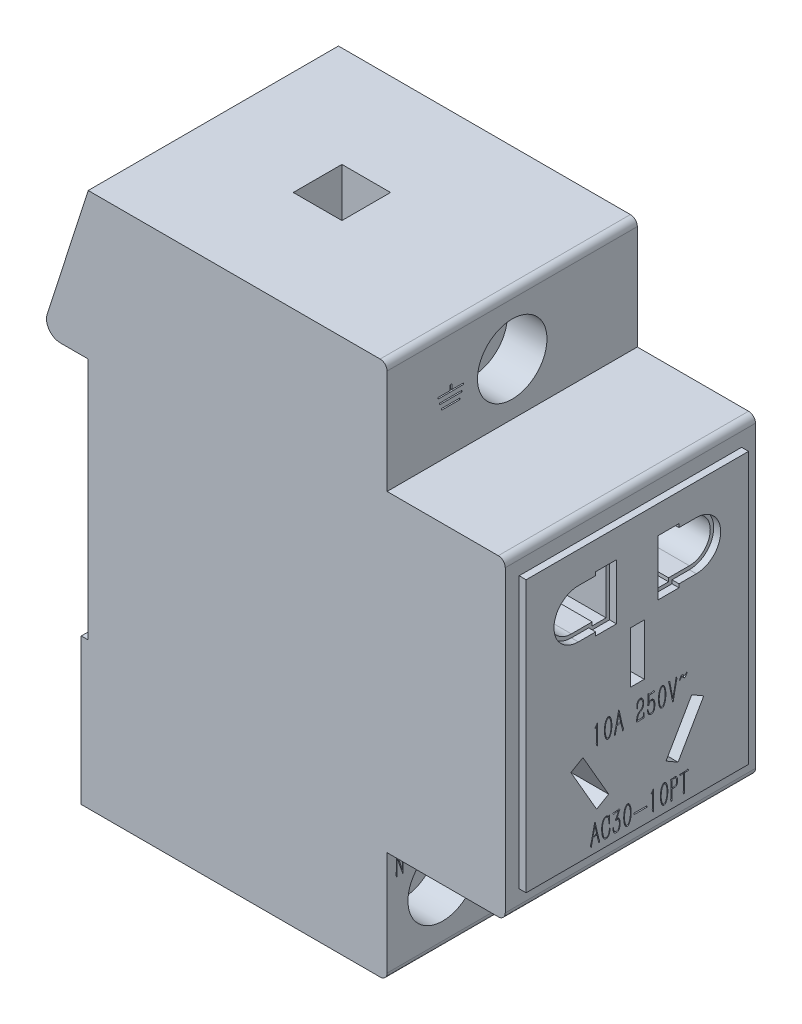
from build123d import *

# Parameters (mm, degrees)
EXTRUDE_1_DEPTH           = 18
SKETCH_2_W                = 32
SKETCH_2_H                = 32
CUT_EXTRUDE_1_DEPTH       = 34
HOLE_WIZARD_1_D           = 5.5
HOLE_WIZARD_1_DEPTH       = 7.5
HOLE_WIZARD_1_CBORE_D     = 10
HOLE_WIZARD_1_CBORE_DEPTH = 5.7
HOLE_WIZARD_1_TIP         = 1.652366702
HOLE_WIZARD_3_D           = 5.5
HOLE_WIZARD_3_DEPTH       = 7.5
HOLE_WIZARD_3_CBORE_D     = 10
HOLE_WIZARD_3_CBORE_DEPTH = 5.7
HOLE_WIZARD_3_TIP         = 1.652366702
SKETCH_13_W               = 32
SKETCH_13_H               = 39
EXTRUDE_2_DEPTH           = 1
SKETCH_3P_W               = 2
SKETCH_3P_H               = 7.4
CUT_EXTRUDE_2_DEPTH       = 12
SKETCH_15_W               = 7
SKETCH_15_H               = 7
CUT_EXTRUDE_3_DEPTH       = 12
SKETCH_16_W               = 7
SKETCH_16_H               = 7
CUT_EXTRUDE_4_DEPTH       = 12
CUT_EXTRUDE_5_REACH       = 105
SKETCH_17_W               = 5
SKETCH_17_H               = 10.932340583
SKETCH_17_H_2             = 13.985516782
CUT_EXTRUDE_8_DEPTH       = 0.25
SKETCH_4184_W             = 3.212328767
SKETCH_4184_H             = 0.191780822
SKETCH_4184_W_2           = 2.636986302
CUT_EXTRUDE_9_DEPTH       = 0.25
CUT_EXTRUDE_10_DEPTH      = 1
CUT_EXTRUDE_11_DEPTH      = 10
CUT_EXTRUDE_12_DEPTH      = 0.25
AC30_10PT_W               = 1.855103346
AC30_10PT_H               = 0.186021734
CUT_EXTRUDE_13_DEPTH      = 0.25


with BuildPart() as part:
    # Sketch 225 → 凸台-拉伸1 (new, symmetric)
    with BuildSketch(Plane.XY):
        with BuildLine():
            Line((0, 1), (0, 20))
            ThreePointArc((0, 20), (0.292893219, 20.707106781), (1, 21))
            Line((1, 21), (5, 21))
            Line((5, 21), (5, 56))
            Line((5, 56), (1, 56))
            ThreePointArc((1, 56), (-0.615989127, 56.82162012), (-0.904249074, 58.611420858))
            Line((-0.904249074, 58.611420858), (5, 77))
            Line((5, 77), (47, 77))
            ThreePointArc((47, 77), (47.707106781, 76.707106781), (48, 76))
            Line((48, 76), (48, 61))
            Line((48, 61), (64, 61))
            ThreePointArc((64, 61), (64.707106781, 60.707106781), (65, 60))
            Line((65, 60), (65, 17))
            ThreePointArc((65, 17), (64.707106781, 16.292893219), (64, 16))
            Line((64, 16), (48, 16))
            Line((48, 16), (48, 1))
            ThreePointArc((48, 1), (47.707106781, 0.292893219), (47, 0))
            Line((47, 0), (1, 0))
            ThreePointArc((1, 0), (0.292893219, 0.292893219), (0, 1))
        make_face()
    extrude(amount=EXTRUDE_1_DEPTH, both=True)

    # 草图2 → 切除-拉伸1 (cut)
    with BuildSketch(Plane.ZY.offset(-5)):
        with Locations((0, 38.500117389)):
            Rectangle(SKETCH_2_W, SKETCH_2_H)
    extrude(amount=-CUT_EXTRUDE_1_DEPTH, mode=Mode.SUBTRACT)

    # 打孔尺寸(%根据)开槽圆柱头螺钉的类型1
    with Locations(Plane(origin=(48, 0, 0), x_dir=(0, 0, -1), z_dir=(1, 0, 0))):
        with Locations((0, 68.5)):
            CounterBoreHole(HOLE_WIZARD_1_D / 2, HOLE_WIZARD_1_CBORE_D / 2, HOLE_WIZARD_1_CBORE_DEPTH, depth=HOLE_WIZARD_1_DEPTH)
            with Locations((0, 0, -(HOLE_WIZARD_1_DEPTH + HOLE_WIZARD_1_TIP / 2))):  # 118° drill point
                Cone(0, HOLE_WIZARD_1_D / 2, HOLE_WIZARD_1_TIP, mode=Mode.SUBTRACT)

    # 打孔尺寸(%根据)开槽圆柱头螺钉的类型3
    with Locations(Plane(origin=(48, 0, 0), x_dir=(0, 0, -1), z_dir=(1, 0, 0))):
        with Locations((10, 8.405431572), (-10.003496092, 8.477343962)):
            CounterBoreHole(HOLE_WIZARD_3_D / 2, HOLE_WIZARD_3_CBORE_D / 2, HOLE_WIZARD_3_CBORE_DEPTH, depth=HOLE_WIZARD_3_DEPTH)
            with Locations((0, 0, -(HOLE_WIZARD_3_DEPTH + HOLE_WIZARD_3_TIP / 2))):  # 118° drill point
                Cone(0, HOLE_WIZARD_3_D / 2, HOLE_WIZARD_3_TIP, mode=Mode.SUBTRACT)

    # 草图13 → 凸台-拉伸2 (add)
    with BuildSketch(Plane(origin=(65, 0, 0), x_dir=(0, 0, -1), z_dir=(1, 0, 0))):
        with Locations((0, 38.5)):
            Rectangle(SKETCH_13_W, SKETCH_13_H)
    extrude(amount=EXTRUDE_2_DEPTH)

    # 3P插孔 → 切除-拉伸2 (cut)
    with BuildSketch(Plane(origin=(66, 0, 0), x_dir=(0, 0, -1), z_dir=(1, 0, 0))):
        Polygon((4.125575286, 25.345706006), (5.857626094, 24.345706006), (9.557626094, 30.754293994), (7.825575286, 31.754293994), align=None)
        Polygon((-4.125575286, 25.345706006), (-5.857626094, 24.345706006), (-9.557626094, 30.754293994), (-7.825575286, 31.754293994), align=None)
        with Locations((0, 40.8)):
            Rectangle(SKETCH_3P_W, SKETCH_3P_H)
    extrude(amount=-CUT_EXTRUDE_2_DEPTH, mode=Mode.SUBTRACT)

    # 草图15 → 切除-拉伸3 (cut)
    with BuildSketch(Plane(origin=(0, 77, 0), x_dir=(1, 0, 0), z_dir=(0, 1, 0))):
        with Locations((23.5, 0)):
            Rectangle(SKETCH_15_W, SKETCH_15_H)
    extrude(amount=-CUT_EXTRUDE_3_DEPTH, mode=Mode.SUBTRACT)

    # 草图16 → 切除-拉伸4 (cut)
    with BuildSketch(Plane.XZ):
        with Locations((24.5, 9)):
            Rectangle(SKETCH_16_W, SKETCH_16_H)
        with Locations((24.5, -9)):
            Rectangle(SKETCH_16_W, SKETCH_16_H)
    extrude(amount=-CUT_EXTRUDE_4_DEPTH, mode=Mode.SUBTRACT)

    # 切除-拉伸5: up to this face of the body (flat: up to its plane)
    cut_extrude_5_end = Plane(part.part.faces().sort_by_distance((3, 21, 0))[0])
    # 草图17 → 切除-拉伸5 (cut, up to the picked face)
    with BuildSketch(Plane.XZ, mode=Mode.PRIVATE) as cut_extrude_5_sk1:
        with Locations((1.5, -14.466170292)):
            Rectangle(SKETCH_17_W, SKETCH_17_H)
    cut_extrude_5_tool1 = split(extrude(cut_extrude_5_sk1.sketch, amount=-CUT_EXTRUDE_5_REACH, mode=Mode.PRIVATE), bisect_by=cut_extrude_5_end, keep=Keep.BOTH, mode=Mode.PRIVATE)
    # 草图17 → 切除-拉伸5 (cut, up to the picked face)
    with BuildSketch(Plane.XZ, mode=Mode.PRIVATE) as cut_extrude_5_sk2:
        with Locations((1.5, 14.466170292)):
            Rectangle(SKETCH_17_W, SKETCH_17_H)
    cut_extrude_5_tool2 = split(extrude(cut_extrude_5_sk2.sketch, amount=-CUT_EXTRUDE_5_REACH, mode=Mode.PRIVATE), bisect_by=cut_extrude_5_end, keep=Keep.BOTH, mode=Mode.PRIVATE)
    # 草图17 → 切除-拉伸5 (cut, up to the picked face)
    with BuildSketch(Plane.XZ, mode=Mode.PRIVATE) as cut_extrude_5_sk3:
        with Locations((1.5, 0)):
            Rectangle(SKETCH_17_W, SKETCH_17_H_2)
    cut_extrude_5_tool3 = split(extrude(cut_extrude_5_sk3.sketch, amount=-CUT_EXTRUDE_5_REACH, mode=Mode.PRIVATE), bisect_by=cut_extrude_5_end, keep=Keep.BOTH, mode=Mode.PRIVATE)
    add(cut_extrude_5_tool1.solids().sort_by(Axis((1.5, 0, -14.46617), (0, 1, 0)))[0], mode=Mode.SUBTRACT)
    add(cut_extrude_5_tool2.solids().sort_by(Axis((1.5, 0, 14.46617), (0, 1, 0)))[0], mode=Mode.SUBTRACT)
    add(cut_extrude_5_tool3.solids().sort_by(Axis((1.5, 0, 0), (0, 1, 0)))[0], mode=Mode.SUBTRACT)

    # 文字NL → 切除-拉伸8 (cut)
    with BuildSketch(Plane(origin=(48, 0, 0), x_dir=(0, 0, -1), z_dir=(1, 0, 0))):
        with BuildLine():
            Line((-15.858308961, 15.129290688), (-15.819314715, 15.168284935))
            Line((-15.819314715, 15.168284935), (-15.63393223, 14.939433454))
            add(Edge.make_bspline(
                [(-15.63393223, 14.939433454), (-15.637971601, 14.925510106), (-15.645786713, 14.898572115), (-15.658778724, 14.865663096), (-15.666491696, 14.837127369), (-15.671583386, 14.811075408), (-15.675869262, 14.779906131), (-15.680602388, 14.734537743), (-15.683823204, 14.682282732), (-15.685143216, 14.642184563), (-15.685711476, 14.62492248)],
                knots=[0, 0, 0, 0, 1.084494799, 2.098210167, 2.643672211, 3.294173657, 4.083496456, 4.997481927, 6.707429351, 8, 8, 8, 8], degree=3))
            Line((-15.685711476, 14.62492248), (-15.685711476, 12.290381675))
            Line((-15.685711476, 12.290381675), (-15.75027572, 12.290381675))
            Line((-15.75027572, 12.290381675), (-16.561483903, 14.603187982))
            Line((-16.561483903, 14.603187982), (-16.561483903, 12.640051395))
            add(Edge.make_bspline(
                [(-16.561483903, 12.640051395), (-16.561683675, 12.623857669), (-16.562109547, 12.589336094), (-16.56308097, 12.534107363), (-16.566759885, 12.472585737), (-16.57028871, 12.408317789), (-16.573764657, 12.350209841), (-16.579396934, 12.304309049), (-16.582668324, 12.278006743), (-16.591349474, 12.258681403), (-16.609120595, 12.26610328), (-16.623111786, 12.281610371), (-16.638624839, 12.311440862), (-16.647163821, 12.335888154), (-16.652257395, 12.35047117)],
                knots=[0, 0, 0, 0, 1.182286761, 2.52038347, 4.031227312, 5.682702803, 7.210982332, 8.306924227, 8.990285397, 9.270708198, 9.606495757, 10.101576878, 10.867574663, 12, 12, 12, 12], degree=3))
            Line((-16.652257395, 12.35047117), (-16.721296389, 12.544803153))
            add(Edge.make_bspline(
                [(-16.721296389, 12.544803153), (-16.725811208, 12.557197304), (-16.73340685, 12.578048979), (-16.738534654, 12.609578182), (-16.730565295, 12.640142958), (-16.722357121, 12.66958661), (-16.714248908, 12.700893291), (-16.707228809, 12.732182566), (-16.700294461, 12.769942341), (-16.693481535, 12.814085396), (-16.685759462, 12.86443879), (-16.682177158, 12.921078302), (-16.678360497, 12.983491763), (-16.678430138, 13.027002649), (-16.678466643, 13.049810611)],
                knots=[0, 0, 0, 0, 0.927779361, 1.560877733, 2.200839638, 3.115853294, 3.718492711, 4.470182357, 5.368516448, 6.414355644, 7.608241643, 8.944514625, 10.398345751, 12, 12, 12, 12], degree=3))
            Line((-16.678466643, 13.049810611), (-16.678466643, 15.138240187))
            Line((-16.678466643, 15.138240187), (-16.613263148, 15.138240187))
            Line((-16.613263148, 15.138240187), (-15.802054966, 12.816484381))
            Line((-15.802054966, 12.816484381), (-15.802054966, 14.62044773))
            add(Edge.make_bspline(
                [(-15.802054966, 14.62044773), (-15.802438721, 14.655826968), (-15.80319507, 14.725556528), (-15.807775139, 14.810985056), (-15.81205756, 14.874672585), (-15.815195733, 14.915377725), (-15.818285119, 14.949279094), (-15.822585276, 14.985133825), (-15.828443339, 15.024755756), (-15.836899063, 15.05456871), (-15.841049213, 15.069201193)],
                knots=[0, 0, 0, 0, 1.880234277, 3.705786779, 4.545737466, 5.272737238, 5.875620033, 6.354622927, 7.192433219, 8, 8, 8, 8], degree=3))
            Line((-15.841049213, 15.069201193), (-15.858308961, 15.129290688))
        make_face()
        with BuildLine():
            Line((15.719999157, 15.190019433), (15.750043905, 15.22453893))
            Line((15.750043905, 15.22453893), (15.939901139, 14.9873772))
            add(Edge.make_bspline(
                [(15.939901139, 14.9873772), (15.934413899, 14.977124004), (15.923575527, 14.956871937), (15.905662672, 14.925671471), (15.891619965, 14.886621156), (15.882536313, 14.837504053), (15.876114221, 14.778934004), (15.875604225, 14.737024797), (15.875336894, 14.715056723)],
                knots=[0, 0, 0, 0, 0.736410598, 1.454555069, 2.274010016, 3.348139226, 4.609940921, 6, 6, 6, 6], degree=3))
            Line((15.875336894, 14.715056723), (15.875336894, 12.514758406))
            add(Edge.make_bspline(
                [(15.875336894, 12.514758406), (15.89302622, 12.514569391), (15.925427307, 12.514223176), (15.968866838, 12.516311815), (16.002802244, 12.516125273), (16.030526331, 12.518437343), (16.060084727, 12.522394397), (16.0984165, 12.527473875), (16.14963674, 12.53368396), (16.209273112, 12.54222452), (16.269783159, 12.551216792), (16.322663977, 12.559310332), (16.363769499, 12.566532103), (16.402435944, 12.573222586), (16.440406373, 12.586399258), (16.47372666, 12.610706057), (16.495149683, 12.635366244), (16.511825174, 12.641643957), (16.517783091, 12.643886895)],
                knots=[0, 0, 0, 0, 1.271684107, 2.329311289, 3.126176351, 3.710204741, 4.32783396, 5.270448411, 6.49050515, 8.03759688, 9.602040843, 10.889228832, 11.884182716, 12.602334394, 13.712376462, 14.732953672, 15.547302315, 16, 16, 16, 16], degree=3))
            add(Edge.make_bspline(
                [(16.517783091, 12.643886895), (16.520568912, 12.641775645), (16.528661157, 12.635642892), (16.544832999, 12.621710409), (16.571645081, 12.599615249), (16.604156216, 12.568113987), (16.637525577, 12.537241829), (16.664069343, 12.512709475), (16.683134058, 12.495210113), (16.690516303, 12.477090119), (16.693595927, 12.462448914), (16.694482177, 12.453825137), (16.694855326, 12.450194161)],
                knots=[0, 0, 0, 0, 0.390394386, 1.134016561, 2.38360509, 4.269889804, 6.18981564, 7.453157385, 8.329021544, 9.032311711, 9.592562279, 10, 10, 10, 10], degree=3))
            add(Edge.make_bspline(
                [(16.694855326, 12.450194161), (16.693071042, 12.446083413), (16.689483635, 12.437818518), (16.676808579, 12.42980192), (16.660430032, 12.425544544), (16.631936202, 12.426025216), (16.59111108, 12.427374447), (16.538155721, 12.419157293), (16.481316641, 12.411273458), (16.436198417, 12.404218465), (16.401919976, 12.399240237), (16.376922271, 12.39703596), (16.345440106, 12.393502117), (16.307243975, 12.390670983), (16.262508824, 12.386703143), (16.211152108, 12.382267801), (16.153224555, 12.37699675), (16.112290024, 12.373856831), (16.090764126, 12.372205668)],
                knots=[0, 0, 0, 0, 0.341365878, 0.68633572, 1.116730632, 1.647491765, 2.890856209, 4.29325764, 5.800779701, 7.359923239, 7.845242571, 8.495183841, 9.311733456, 10.309872826, 11.474601469, 12.805924266, 14.320358265, 16, 16, 16, 16], degree=3))
            Line((16.090764126, 12.372205668), (15.909856391, 12.354945919))
            Line((15.909856391, 12.354945919), (15.8101334, 12.34663567))
            add(Edge.make_bspline(
                [(15.8101334, 12.34663567), (15.799752703, 12.343253308), (15.782928033, 12.337771294), (15.758116567, 12.341302982), (15.747346287, 12.355667108), (15.73900197, 12.371422466), (15.739631891, 12.395985772), (15.744255929, 12.430064179), (15.750235801, 12.476971728), (15.752993002, 12.51240934), (15.754518654, 12.532018154)],
                knots=[0, 0, 0, 0, 1.058270145, 1.715207142, 2.242218181, 2.723015089, 3.427046488, 4.550153686, 6.091084828, 8, 8, 8, 8], degree=3))
            Line((15.754518654, 12.532018154), (15.762828904, 12.786439633))
            Line((15.762828904, 12.786439633), (15.762828904, 14.728480971))
            add(Edge.make_bspline(
                [(15.762828904, 14.728480971), (15.762919417, 14.752560279), (15.763082024, 14.795818981), (15.76213617, 14.853131857), (15.761963916, 14.895769921), (15.760023833, 14.933903943), (15.757702347, 14.974407376), (15.754195604, 15.024631348), (15.74617821, 15.083159101), (15.73464075, 15.124089372), (15.728309407, 15.146550437)],
                knots=[0, 0, 0, 0, 1.372323329, 2.465391677, 3.267017655, 3.801925377, 4.641299591, 5.579257235, 6.671583216, 8, 8, 8, 8], degree=3))
            Line((15.728309407, 15.146550437), (15.719999157, 15.190019433))
        make_face()
    extrude(amount=-CUT_EXTRUDE_8_DEPTH, mode=Mode.SUBTRACT)

    # Sketch 4184 → 切除-拉伸9 (cut)
    with BuildSketch(Plane(origin=(48, 0, 0), x_dir=(0, 0, -1), z_dir=(1, 0, 0))):
        Polygon((-6.975896963, 68.840264124), (-10.667677785, 68.840264124), (-10.667677785, 69.032044946), (-8.941650388, 69.032044946), (-8.941650388, 69.751223029), (-8.653230011, 69.751223029), (-8.653230011, 69.032044946), (-6.975896963, 69.032044946), align=None)
        with Locations((-8.821787374, 68.121086042)):
            Rectangle(SKETCH_4184_W, SKETCH_4184_H)
        with Locations((-8.821787374, 67.306017549)):
            Rectangle(SKETCH_4184_W_2, SKETCH_4184_H)
    extrude(amount=-CUT_EXTRUDE_9_DEPTH, mode=Mode.SUBTRACT)

    # 2P插孔 → 切除-拉伸10 (cut)
    with BuildSketch(Plane(origin=(66, 0, 0), x_dir=(0, 0, -1), z_dir=(1, 0, 0))):
        with BuildLine():
            Line((-2.992069107, 46), (-2.992069107, 54))
            Line((-2.992069107, 54), (-5.992069107, 54))
            Line((-5.992069107, 54), (-5.992069107, 53.5))
            Line((-5.992069107, 53.5), (-8.492069107, 53.5))
            ThreePointArc((-8.492069107, 53.5), (-11.992069107, 50), (-8.492069107, 46.5))
            Line((-8.492069107, 46.5), (-5.992069107, 46.5))
            Line((-5.992069107, 46.5), (-5.992069107, 46))
            Line((-5.992069107, 46), (-2.992069107, 46))
        make_face()
        with BuildLine():
            Line((8.492069107, 46.5), (5.992069107, 46.5))
            Line((5.992069107, 46.5), (5.992069107, 46))
            Line((5.992069107, 46), (2.992069107, 46))
            Line((2.992069107, 46), (2.992069107, 54))
            Line((2.992069107, 54), (5.992069107, 54))
            Line((5.992069107, 54), (5.992069107, 53.5))
            Line((5.992069107, 53.5), (8.492069107, 53.5))
            ThreePointArc((8.492069107, 53.5), (11.992069107, 50), (8.492069107, 46.5))
        make_face()
    extrude(amount=-CUT_EXTRUDE_10_DEPTH, mode=Mode.SUBTRACT)

    # 2P插孔<4> → 切除-拉伸11 (cut)
    with BuildSketch(Plane(origin=(66, 0, 0), x_dir=(0, 0, -1), z_dir=(1, 0, 0))):
        with BuildLine():
            Line((8.492069107, 53), (5.492069107, 53))
            Line((5.492069107, 53), (5.492069107, 53.5))
            Line((5.492069107, 53.5), (3.492069107, 53.5))
            Line((3.492069107, 53.5), (3.492069107, 46.5))
            Line((3.492069107, 46.5), (5.492069107, 46.5))
            Line((5.492069107, 46.5), (5.492069107, 47))
            Line((5.492069107, 47), (8.492069107, 47))
            ThreePointArc((8.492069107, 47), (11.492069107, 50), (8.492069107, 53))
        make_face()
        with BuildLine():
            Line((-8.492069107, 47), (-5.492069107, 47))
            Line((-5.492069107, 47), (-5.492069107, 46.5))
            Line((-5.492069107, 46.5), (-3.492069107, 46.5))
            Line((-3.492069107, 46.5), (-3.492069107, 53.5))
            Line((-3.492069107, 53.5), (-5.492069107, 53.5))
            Line((-5.492069107, 53.5), (-5.492069107, 53))
            Line((-5.492069107, 53), (-8.492069107, 53))
            ThreePointArc((-8.492069107, 53), (-11.492069107, 50), (-8.492069107, 47))
        make_face()
    extrude(amount=-CUT_EXTRUDE_11_DEPTH, mode=Mode.SUBTRACT)

    # 文字10A250V → 切除-拉伸12 (cut)
    # profile 1 of 8: a face of its own
    with BuildSketch(Plane(origin=(66, 0, 0), x_dir=(0, 0, -1), z_dir=(1, 0, 0))):
        with BuildLine():
            Line((-5.763969673, 35.025356493), (-5.716665177, 35.025356493))
            Line((-5.716665177, 35.025356493), (-5.721139927, 32.733645434))
            add(Edge.make_bspline(
                [(-5.721139927, 32.733645434), (-5.721649685, 32.712977758), (-5.722627089, 32.673349789), (-5.722706413, 32.616652443), (-5.724571052, 32.565318255), (-5.72471957, 32.519273728), (-5.726106086, 32.478579016), (-5.727709457, 32.443225602), (-5.727861808, 32.413147218), (-5.730697886, 32.366070664), (-5.734077447, 32.301343913), (-5.742458586, 32.234676459), (-5.749130603, 32.187173109), (-5.755913258, 32.165548754), (-5.764506186, 32.148438855), (-5.773081912, 32.150434185), (-5.776754672, 32.151288733)],
                knots=[0, 0, 0, 0, 1.45038606, 2.780953852, 3.977268029, 5.053718292, 6.010937745, 6.833690271, 7.536464333, 8.120251454, 10.142880859, 12.069479857, 12.873132744, 13.440417135, 13.76034519, 14, 14, 14, 14], degree=3))
            add(Edge.make_bspline(
                [(-5.776754672, 32.151288733), (-5.777603697, 32.151931387), (-5.781237732, 32.154682102), (-5.789903898, 32.160504353), (-5.800201091, 32.176111244), (-5.804708558, 32.190112722), (-5.80743867, 32.198593229)],
                knots=[0, 0, 0, 0, 0.221265066, 0.947068446, 2.150880552, 4, 4, 4, 4], degree=3))
            Line((-5.80743867, 32.198593229), (-5.828533918, 32.254847224))
            Line((-5.828533918, 32.254847224), (-5.876477664, 32.410184961))
            add(Edge.make_bspline(
                [(-5.876477664, 32.410184961), (-5.882249057, 32.424800642), (-5.892302525, 32.450260403), (-5.902444256, 32.483756255), (-5.910138115, 32.505144771), (-5.912183081, 32.522481094), (-5.902332472, 32.53874261), (-5.895077836, 32.563780387), (-5.88391489, 32.595739462), (-5.873373245, 32.633459831), (-5.864062486, 32.674216094), (-5.855675117, 32.718251955), (-5.850921753, 32.767865726), (-5.848590044, 32.815236462), (-5.846800595, 32.860844549), (-5.84647548, 32.904752432), (-5.845578768, 32.956740708), (-5.845718852, 32.994245752), (-5.845793666, 33.014276161)],
                knots=[0, 0, 0, 0, 1.220359697, 2.125803599, 2.712350858, 2.994193817, 3.439826662, 4.12562012, 5.031064022, 6.063176816, 7.167225426, 8.277459231, 9.542238136, 11.034069985, 11.961482632, 13.08703073, 14.444263491, 16, 16, 16, 16], degree=3))
            Line((-5.845793666, 33.014276161), (-5.841958167, 34.70573152))
            Line((-5.841958167, 34.70573152), (-6.066334898, 34.511399536))
            Line((-6.066334898, 34.511399536), (-6.083594647, 34.58491328))
            add(Edge.make_bspline(
                [(-6.083594647, 34.58491328), (-6.065355985, 34.603759382), (-6.031166861, 34.639087178), (-5.985475037, 34.689952854), (-5.947895109, 34.734096205), (-5.908753108, 34.785701849), (-5.864929172, 34.849924753), (-5.832566578, 34.902688735), (-5.815748919, 34.930108251)],
                knots=[0, 0, 0, 0, 1.077185482, 2.019228619, 2.808185376, 3.45765616, 4.678836699, 6, 6, 6, 6], degree=3))
            Line((-5.815748919, 34.930108251), (-5.763969673, 35.025356493))
        make_face()
    # profile 2 of 8: a face of its own
    with BuildSketch(Plane(origin=(66, 0, 0), x_dir=(0, 0, -1), z_dir=(1, 0, 0))):
        with BuildLine():
            add(Edge.make_bspline(
                [(-4.736055759, 33.679096105), (-4.733972566, 33.720450667), (-4.729704495, 33.805178415), (-4.718101795, 33.935046036), (-4.700987432, 34.070528087), (-4.681141297, 34.209665495), (-4.653679593, 34.347113794), (-4.618533754, 34.477825986), (-4.573667283, 34.598680699), (-4.528897564, 34.691481641), (-4.491051279, 34.75952214), (-4.463514492, 34.804784318), (-4.437317075, 34.845603091), (-4.411506608, 34.881067053), (-4.386173549, 34.911265441), (-4.362810041, 34.937450003), (-4.339231077, 34.957835945), (-4.309659642, 34.978050475), (-4.273664832, 34.996079692), (-4.231953581, 35.011851975), (-4.191818237, 35.02097574), (-4.165672039, 35.020912331), (-4.153059808, 35.020881744)],
                knots=[0, 0, 0, 0, 1.583211401, 3.243703523, 4.983978234, 6.804605119, 8.6166428, 10.340282122, 11.974804003, 13.53820457, 14.274983449, 14.951299633, 15.563740824, 16.129235462, 16.626851747, 17.070813204, 17.469389546, 17.815167281, 18.438300608, 19.002855301, 19.519003895, 20, 20, 20, 20], degree=3))
            add(Edge.make_bspline(
                [(-4.153059808, 35.020881744), (-4.140999648, 35.018772886), (-4.115526713, 35.01431865), (-4.077867322, 34.997756937), (-4.037897302, 34.975731716), (-3.995371293, 34.947185074), (-3.952913119, 34.908802568), (-3.913564526, 34.857966049), (-3.877034262, 34.795880324), (-3.831637746, 34.697620088), (-3.781612322, 34.564435025), (-3.742332607, 34.424592623), (-3.716817728, 34.307830723), (-3.700177944, 34.214673596), (-3.686946653, 34.115889869), (-3.672738345, 33.977019159), (-3.660067146, 33.79906981), (-3.658024936, 33.655681303), (-3.657001849, 33.583847863)],
                knots=[0, 0, 0, 0, 0.36369769, 0.768186139, 1.217229854, 1.724510149, 2.290946358, 2.914777825, 3.632489608, 4.433551378, 6.137860108, 7.866765886, 8.757390638, 9.699141408, 10.686159515, 11.726895222, 13.859299765, 16, 16, 16, 16], degree=3))
            add(Edge.make_bspline(
                [(-3.657001849, 33.583847863), (-3.660915171, 33.526288516), (-3.668957864, 33.40799205), (-3.688090969, 33.226816253), (-3.719646702, 33.03833739), (-3.75935559, 32.879571132), (-3.797763966, 32.753159224), (-3.830335597, 32.661941575), (-3.866779657, 32.575799564), (-3.905676797, 32.495568008), (-3.946141958, 32.424147246), (-3.988029511, 32.364133122), (-4.032291966, 32.317910173), (-4.077765831, 32.284708202), (-4.12216522, 32.262207711), (-4.16458862, 32.247821211), (-4.204988576, 32.239835636), (-4.231236898, 32.241340196), (-4.2438333, 32.242062225)],
                knots=[0, 0, 0, 0, 1.760488992, 3.618172134, 5.557361062, 7.587083219, 8.607294374, 9.588398617, 10.541277716, 11.460251193, 12.307925722, 13.044175775, 13.687957546, 14.251129358, 14.754223989, 15.200440537, 15.616296545, 16, 16, 16, 16], degree=3))
            add(Edge.make_bspline(
                [(-4.2438333, 32.242062225), (-4.255869513, 32.243754101), (-4.281228884, 32.247318753), (-4.319454354, 32.262319227), (-4.359261119, 32.285430918), (-4.401757581, 32.315896876), (-4.44454917, 32.357752538), (-4.485754947, 32.411889949), (-4.525270736, 32.47860328), (-4.562823823, 32.55661985), (-4.598095331, 32.643517028), (-4.628979982, 32.737280425), (-4.657593998, 32.835810154), (-4.680521532, 32.938828164), (-4.699388465, 33.042944461), (-4.714191812, 33.145286057), (-4.724578728, 33.244655687), (-4.730184276, 33.340657018), (-4.732144389, 33.432556191), (-4.73421595, 33.519490645), (-4.735511896, 33.601104194), (-4.735878935, 33.653738849), (-4.736055759, 33.679096105)],
                knots=[0, 0, 0, 0, 0.451175502, 0.950591959, 1.515271951, 2.162531354, 2.891688268, 3.734081857, 4.687580886, 5.773002708, 6.954198864, 8.17563603, 9.445923076, 10.771603705, 12.101713585, 13.383756751, 14.619631726, 15.819374781, 16.961914306, 18.040825747, 19.056148764, 20, 20, 20, 20], degree=3))
        make_face()
        with BuildLine():
            add(Edge.make_bspline(
                [(-4.623547768, 33.670146606), (-4.624002693, 33.649478477), (-4.624968733, 33.605589296), (-4.625887468, 33.535686655), (-4.624173506, 33.457903866), (-4.621244908, 33.343123394), (-4.610492895, 33.193119721), (-4.583012708, 33.013033393), (-4.543765744, 32.838634091), (-4.500519135, 32.701971848), (-4.460256875, 32.604550519), (-4.429361339, 32.544087331), (-4.396858118, 32.495241321), (-4.362804589, 32.458034918), (-4.328358598, 32.431667334), (-4.296167546, 32.412825619), (-4.26566252, 32.399887504), (-4.245218533, 32.398200173), (-4.235523051, 32.397399962)],
                knots=[0, 0, 0, 0, 0.705717407, 1.498604912, 2.386138873, 3.361274458, 5.418191474, 7.514713171, 9.57394393, 11.515405308, 12.398906158, 13.169972934, 13.829695216, 14.395845116, 14.883250105, 15.303691084, 15.669778158, 16, 16, 16, 16], degree=3))
            add(Edge.make_bspline(
                [(-4.235523051, 32.397399962), (-4.226547211, 32.397515408), (-4.207267228, 32.397763385), (-4.177102791, 32.405017413), (-4.1453911, 32.420287382), (-4.110215712, 32.440353456), (-4.074079214, 32.471235684), (-4.038411846, 32.513439768), (-4.003452446, 32.567529173), (-3.968586987, 32.631488176), (-3.935606791, 32.7026463), (-3.906063477, 32.77803581), (-3.880352875, 32.855858832), (-3.852546641, 32.964738503), (-3.823960492, 33.105951231), (-3.798283597, 33.27839504), (-3.781255541, 33.448449276), (-3.774164252, 33.58718101), (-3.772191726, 33.696995134), (-3.773831011, 33.784380679), (-3.776923891, 33.878154588), (-3.780465268, 33.942898759), (-3.782294838, 33.976347331)],
                knots=[0, 0, 0, 0, 0.308126263, 0.661851094, 1.055455993, 1.515432549, 2.051181639, 2.679899785, 3.409545513, 4.262246801, 5.183512362, 6.104777924, 7.045624675, 8.000099589, 9.967578284, 11.997814557, 13.993544283, 15.842664909, 16.77344086, 17.770161498, 18.848005724, 20, 20, 20, 20], degree=3))
            add(Edge.make_bspline(
                [(-3.782294838, 33.976347331), (-3.785377828, 34.007681836), (-3.791361867, 34.068501658), (-3.801882255, 34.156400575), (-3.814936922, 34.237979006), (-3.833331904, 34.338481926), (-3.863026228, 34.459075341), (-3.903928061, 34.573883915), (-3.939205416, 34.660565477), (-3.969527308, 34.715486429), (-4.000367066, 34.762095113), (-4.034637794, 34.797663412), (-4.067996443, 34.825380482), (-4.099393159, 34.846096304), (-4.128717801, 34.860722666), (-4.148464829, 34.864026548), (-4.157534557, 34.865544007)],
                knots=[0, 0, 0, 0, 1.302834758, 2.528783491, 3.662347304, 4.720685654, 6.75648594, 8.792057095, 9.759925264, 10.624039914, 11.384659521, 12.06448684, 12.659424566, 13.175428451, 13.621277708, 14, 14, 14, 14], degree=3))
            add(Edge.make_bspline(
                [(-4.157534557, 34.865544007), (-4.167393817, 34.86482656), (-4.188111631, 34.863318948), (-4.219739252, 34.853624519), (-4.253308068, 34.838465634), (-4.290188046, 34.817438488), (-4.32860643, 34.783690178), (-4.367398739, 34.734289628), (-4.407538681, 34.668763074), (-4.449434036, 34.588099952), (-4.489463945, 34.493062815), (-4.523474545, 34.38420632), (-4.552864186, 34.263372025), (-4.575001185, 34.133966727), (-4.592883446, 34.004453032), (-4.606826603, 33.88271712), (-4.61750839, 33.772553136), (-4.621611665, 33.702976076), (-4.623547768, 33.670146606)],
                knots=[0, 0, 0, 0, 0.347392606, 0.729995465, 1.156884588, 1.644891073, 2.219813456, 2.945627096, 3.849684979, 4.924243867, 6.145708801, 7.477723151, 8.938118981, 10.524254447, 12.100980159, 13.544449593, 14.841364989, 16, 16, 16, 16], degree=3))
        make_face(mode=Mode.SUBTRACT)
    # profile 3 of 8: a face of its own
    with BuildSketch(Plane(origin=(66, 0, 0), x_dir=(0, 0, -1), z_dir=(1, 0, 0))):
        with BuildLine():
            Line((-2.374027206, 33.38951588), (-2.960858657, 33.247602391))
            Line((-2.960858657, 33.247602391), (-3.098936645, 32.604516945))
            Line((-3.098936645, 32.604516945), (-3.16414014, 32.276581722))
            Line((-3.16414014, 32.276581722), (-3.189710138, 32.173023231))
            add(Edge.make_bspline(
                [(-3.189710138, 32.173023231), (-3.192425334, 32.165687731), (-3.197004258, 32.153317096), (-3.205620027, 32.138762916), (-3.215074743, 32.131530241), (-3.225631039, 32.130005564), (-3.23355053, 32.139159159), (-3.23825982, 32.1507597), (-3.239669404, 32.167783657), (-3.243586274, 32.189948216), (-3.246035776, 32.221655323), (-3.248846461, 32.245699503), (-3.250438883, 32.259321974)],
                knots=[0, 0, 0, 0, 1.226577759, 2.068508672, 2.595953142, 3.064162245, 3.560072257, 4.322224954, 5.029865969, 6.20926766, 7.852322798, 10, 10, 10, 10], degree=3))
            Line((-3.250438883, 32.259321974), (-3.271534131, 32.440229709))
            add(Edge.make_bspline(
                [(-3.271534131, 32.440229709), (-3.272897707, 32.455137288), (-3.275330336, 32.481732522), (-3.277467759, 32.516919193), (-3.277606539, 32.542305992), (-3.276376355, 32.563544437), (-3.270087203, 32.583629117), (-3.262615731, 32.597393612), (-3.258749132, 32.604516945)],
                knots=[0, 0, 0, 0, 1.603576797, 2.86079302, 3.773774944, 4.323462854, 5.1323669, 6, 6, 6, 6], degree=3))
            Line((-3.258749132, 32.604516945), (-3.237014634, 32.643511192))
            add(Edge.make_bspline(
                [(-3.237014634, 32.643511192), (-3.232359689, 32.653667346), (-3.221242681, 32.677922423), (-3.207166445, 32.722574656), (-3.192169725, 32.78071256), (-3.177058371, 32.847628255), (-3.162245828, 32.91243033), (-3.150412392, 32.965231839), (-3.141329985, 33.000256264), (-3.135423087, 33.017487735), (-3.133456142, 33.02322566)],
                knots=[0, 0, 0, 0, 0.679694972, 1.623257572, 2.844174753, 4.335796169, 5.799225578, 6.891200865, 7.630779852, 8, 8, 8, 8], degree=3))
            Line((-3.133456142, 33.02322566), (-2.68917743, 35.080971239))
            Line((-2.68917743, 35.080971239), (-2.629087935, 35.080971239))
            Line((-2.629087935, 35.080971239), (-2.210379219, 33.230342643))
            Line((-2.210379219, 33.230342643), (-2.158599974, 33.014276161))
            add(Edge.make_bspline(
                [(-2.158599974, 33.014276161), (-2.153406033, 32.989953576), (-2.144088863, 32.946322422), (-2.12991078, 32.888378342), (-2.118282813, 32.844986701), (-2.11010643, 32.821194776), (-2.106820728, 32.811633928)],
                knots=[0, 0, 0, 0, 1.425899692, 2.557855139, 3.420470246, 4, 4, 4, 4], degree=3))
            Line((-2.106820728, 32.811633928), (-2.076775981, 32.729809935))
            add(Edge.make_bspline(
                [(-2.076775981, 32.729809935), (-2.07331761, 32.717823895), (-2.067016592, 32.695985795), (-2.056253157, 32.667083345), (-2.045675115, 32.644766699), (-2.032206647, 32.625971452), (-2.018544907, 32.611864912), (-2.009114849, 32.59723578), (-2.007923521, 32.583579058), (-2.009575291, 32.571059226), (-2.011339241, 32.555113734), (-2.012197535, 32.535035846), (-2.014476064, 32.507373093), (-2.015482585, 32.48647364), (-2.016047236, 32.474749206)],
                knots=[0, 0, 0, 0, 1.645080438, 2.997272953, 4.065812928, 4.892545225, 6.029861332, 6.67147811, 7.124734071, 7.80170629, 8.338742145, 9.240009017, 10.451666043, 12, 12, 12, 12], degree=3))
            Line((-2.016047236, 32.474749206), (-2.033306984, 32.281056472))
            Line((-2.033306984, 32.281056472), (-2.042256483, 32.207542728))
            add(Edge.make_bspline(
                [(-2.042256483, 32.207542728), (-2.042681989, 32.199205809), (-2.043438345, 32.184386566), (-2.047084654, 32.165297607), (-2.049471905, 32.151441365), (-2.054501284, 32.141416821), (-2.064056661, 32.136459998), (-2.075902646, 32.139917368), (-2.085007324, 32.151899281), (-2.087883796, 32.162416317), (-2.089560979, 32.168548481)],
                knots=[0, 0, 0, 0, 1.663187075, 2.956388731, 3.874273883, 4.464983498, 5.130530035, 5.83179128, 6.735783313, 8, 8, 8, 8], degree=3))
            Line((-2.089560979, 32.168548481), (-2.119605727, 32.341145967))
            Line((-2.119605727, 32.341145967), (-2.374027206, 33.38951588))
        make_face()
        with BuildLine():
            Line((-2.382976705, 33.454719374), (-2.659132682, 34.666737273))
            Line((-2.659132682, 34.666737273), (-2.939763409, 33.398465379))
            add(Edge.make_bspline(
                [(-2.939763409, 33.398465379), (-2.915418856, 33.402217775), (-2.873390313, 33.408695928), (-2.814811794, 33.421561448), (-2.759371075, 33.43679022), (-2.710139352, 33.45041228), (-2.669473209, 33.464231616), (-2.642902589, 33.473375712), (-2.622716717, 33.482824094), (-2.611980024, 33.489987543), (-2.607353436, 33.493074371)],
                knots=[0, 0, 0, 0, 1.70172219, 2.937860729, 4.141475294, 5.674569601, 6.46612829, 7.108957565, 7.616037637, 8, 8, 8, 8], degree=3))
            Line((-2.607353436, 33.493074371), (-2.499320195, 33.566588115))
            Line((-2.499320195, 33.566588115), (-2.382976705, 33.454719374))
        make_face(mode=Mode.SUBTRACT)
    # profile 4 of 8: a face of its own
    with BuildSketch(Plane(origin=(66, 0, 0), x_dir=(0, 0, -1), z_dir=(1, 0, 0))):
        with BuildLine():
            Line((-0.006884653, 33.911783086), (-0.072088148, 33.911783086))
            add(Edge.make_bspline(
                [(-0.072088148, 33.911783086), (-0.073431637, 33.932448162), (-0.075992892, 33.971844492), (-0.078635758, 34.028106728), (-0.079751854, 34.078623337), (-0.080869925, 34.140209002), (-0.079145578, 34.217876311), (-0.07451556, 34.280434324), (-0.072088148, 34.313232053)],
                knots=[0, 0, 0, 0, 0.927540379, 1.768282303, 2.522502339, 3.190652681, 4.527123766, 6, 6, 6, 6], degree=3))
            add(Edge.make_bspline(
                [(-0.072088148, 34.313232053), (-0.070408227, 34.337546005), (-0.067159453, 34.384566402), (-0.05858545, 34.452334264), (-0.04866273, 34.5151323), (-0.035762254, 34.57419849), (-0.018331585, 34.632000656), (0.006482857, 34.690139674), (0.037431142, 34.750606872), (0.073995717, 34.811285682), (0.114115692, 34.86854101), (0.159148699, 34.915132938), (0.206279402, 34.950645392), (0.256425352, 34.971780715), (0.304572727, 34.98492387), (0.348479189, 34.995262362), (0.387934829, 35.002487571), (0.412862884, 35.003258657), (0.424609061, 35.003621995)],
                knots=[0, 0, 0, 0, 1.238521709, 2.395159043, 3.470603583, 4.46912877, 5.466066804, 6.534123646, 7.677244524, 8.916145015, 10.13365226, 11.221244199, 12.198275335, 13.109907183, 13.966820176, 14.733954848, 15.403435577, 16, 16, 16, 16], degree=3))
            add(Edge.make_bspline(
                [(0.424609061, 35.003621995), (0.439578371, 35.002518268), (0.469157265, 35.000337336), (0.512666999, 34.990232484), (0.554688471, 34.975662795), (0.608435353, 34.949708492), (0.671283679, 34.909015723), (0.724750861, 34.855579377), (0.761748633, 34.806665391), (0.787809935, 34.765035807), (0.810904361, 34.718550588), (0.839906735, 34.651005984), (0.870247252, 34.561373679), (0.892127282, 34.448167456), (0.906156217, 34.330607834), (0.912574903, 34.210426496), (0.913768388, 34.091429681), (0.906781188, 34.013821889), (0.903407271, 33.976347331)],
                knots=[0, 0, 0, 0, 0.570779476, 1.127842599, 1.694919432, 2.261066821, 3.397481896, 4.527710891, 5.118384485, 5.730727279, 6.394748858, 7.092559246, 8.529363642, 9.986910621, 11.474321506, 13.03467297, 14.568129345, 16, 16, 16, 16], degree=3))
            add(Edge.make_bspline(
                [(0.903407271, 33.976347331), (0.896567807, 33.93779969), (0.882786833, 33.860129271), (0.853104245, 33.766615158), (0.825421867, 33.695520332), (0.802277945, 33.647879557), (0.777548894, 33.605704196), (0.741790834, 33.555827653), (0.687183606, 33.499212201), (0.636581099, 33.461245223), (0.609991546, 33.441295125)],
                knots=[0, 0, 0, 0, 1.490916612, 3.004077927, 3.729534125, 4.397912905, 5.020560084, 5.590839424, 6.734084393, 8, 8, 8, 8], degree=3))
            Line((0.609991546, 33.441295125), (0.398399813, 33.307691886))
            add(Edge.make_bspline(
                [(0.398399813, 33.307691886), (0.371436667, 33.289386945), (0.320309395, 33.254677284), (0.252040373, 33.197980683), (0.194739944, 33.138241182), (0.151429292, 33.072186969), (0.117790796, 33.004193428), (0.087920883, 32.935921264), (0.065370616, 32.860669627), (0.04933199, 32.793219466), (0.038394178, 32.736571479), (0.032915209, 32.697063964), (0.028464288, 32.662146739), (0.027899763, 32.640326608), (0.027634844, 32.630086943)],
                knots=[0, 0, 0, 0, 1.453572249, 2.75625039, 3.953730064, 5.132566341, 6.263730064, 7.337486329, 8.453238547, 9.76321854, 10.430854957, 11.026567013, 11.543191201, 12, 12, 12, 12], degree=3))
            Line((0.027634844, 32.630086943), (0.018685345, 32.449179208))
            Line((0.018685345, 32.449179208), (0.79089928, 32.474749206))
            add(Edge.make_bspline(
                [(0.79089928, 32.474749206), (0.80080809, 32.475303233), (0.818211897, 32.476276324), (0.834938023, 32.494510655), (0.838661066, 32.516774787), (0.845267373, 32.544159029), (0.85017871, 32.583411895), (0.853967463, 32.613263056), (0.856102775, 32.630086943)],
                knots=[0, 0, 0, 0, 0.925905201, 1.626257371, 2.181371879, 3.087088273, 4.358305093, 6, 6, 6, 6], degree=3))
            Line((0.856102775, 32.630086943), (0.873362524, 33.005965912))
            Line((0.873362524, 33.005965912), (0.933452019, 33.005965912))
            Line((0.933452019, 33.005965912), (0.955186517, 32.436394209))
            add(Edge.make_bspline(
                [(0.955186517, 32.436394209), (0.955913113, 32.425321114), (0.95718393, 32.40595426), (0.957802547, 32.380334712), (0.957820056, 32.362495407), (0.957550254, 32.348091978), (0.952911234, 32.335498788), (0.948600652, 32.320886544), (0.931785473, 32.312631314), (0.907614848, 32.309990003), (0.870880873, 32.306249195), (0.842050146, 32.306488452), (0.825418778, 32.30662647)],
                knots=[0, 0, 0, 0, 1.385018147, 2.4223982, 3.193529914, 3.619812046, 4.200562765, 4.878496499, 5.402948042, 6.404258339, 7.925751149, 10, 10, 10, 10], degree=3))
            Line((0.825418778, 32.30662647), (-0.033093901, 32.284891972))
            add(Edge.make_bspline(
                [(-0.033093901, 32.284891972), (-0.043529992, 32.284861441), (-0.064100297, 32.284801264), (-0.085180006, 32.305256099), (-0.094028834, 32.330296793), (-0.098457637, 32.359749675), (-0.101424154, 32.398823898), (-0.102849086, 32.466029159), (-0.099802627, 32.561651919), (-0.092940564, 32.640555712), (-0.089347896, 32.681866189)],
                knots=[0, 0, 0, 0, 0.556373901, 1.096654043, 1.476064089, 2.012759395, 2.73145082, 3.635924119, 5.715166189, 8, 8, 8, 8], degree=3))
            add(Edge.make_bspline(
                [(-0.089347896, 32.681866189), (-0.086159702, 32.705979058), (-0.080018133, 32.752428815), (-0.067530886, 32.819290869), (-0.054217455, 32.881353823), (-0.03976887, 32.938580128), (-0.023818342, 32.990668303), (-0.006408385, 33.037558717), (0.011639718, 33.08000656), (0.038748905, 33.128026179), (0.073202572, 33.18036918), (0.112391726, 33.236807536), (0.150123248, 33.284682418), (0.199440188, 33.337352505), (0.266205882, 33.39484243), (0.322293312, 33.436937978), (0.351095317, 33.458554874)],
                knots=[0, 0, 0, 0, 1.103491021, 2.125706759, 3.085324024, 3.98349739, 4.803138144, 5.555704107, 6.252741852, 6.89323317, 8.054555834, 9.09539633, 10.010480884, 10.817709087, 12.365830683, 14, 14, 14, 14], degree=3))
            Line((0.351095317, 33.458554874), (0.528167552, 33.571062864))
            add(Edge.make_bspline(
                [(0.528167552, 33.571062864), (0.542344079, 33.580488281), (0.56954866, 33.59857554), (0.607123965, 33.627371923), (0.639158321, 33.657250219), (0.666764485, 33.689492802), (0.69175496, 33.726802043), (0.712278654, 33.773307428), (0.733975921, 33.828086293), (0.75927373, 33.913311972), (0.785357598, 34.025802376), (0.795356698, 34.164788699), (0.790015089, 34.305577495), (0.773684782, 34.399023222), (0.765329283, 34.446835291)],
                knots=[0, 0, 0, 0, 0.635613896, 1.219735276, 1.765761318, 2.268061313, 2.802129131, 3.435697723, 4.161225462, 5.001884758, 6.75303811, 8.46119913, 10.189351173, 12, 12, 12, 12], degree=3))
            add(Edge.make_bspline(
                [(0.765329283, 34.446835291), (0.759033272, 34.471209863), (0.74675396, 34.518748373), (0.723512754, 34.587229448), (0.693428437, 34.649600366), (0.661227709, 34.707864381), (0.620886282, 34.758865525), (0.567150895, 34.795494491), (0.503669826, 34.81998011), (0.457235023, 34.824291886), (0.43291931, 34.82654976)],
                knots=[0, 0, 0, 0, 1.101106684, 2.147523679, 3.156537618, 4.125318695, 5.058520457, 5.968677808, 6.93629249, 8, 8, 8, 8], degree=3))
            add(Edge.make_bspline(
                [(0.43291931, 34.82654976), (0.420120114, 34.826680797), (0.394591219, 34.826942159), (0.356567057, 34.821175901), (0.319583321, 34.809085629), (0.271001821, 34.78717268), (0.214864922, 34.746354788), (0.155776612, 34.684768324), (0.107038152, 34.609569911), (0.06951327, 34.522428666), (0.041297353, 34.423151032), (0.018391552, 34.311887775), (0.003350943, 34.187227943), (-0.000851146, 34.099975427), (-0.003049153, 34.054335824)],
                knots=[0, 0, 0, 0, 0.469335518, 0.936122588, 1.403629858, 1.893624907, 2.887406355, 3.927357629, 5.011993806, 6.157121359, 7.396943717, 8.794309501, 10.323183677, 12, 12, 12, 12], degree=3))
            Line((-0.003049153, 34.054335824), (-0.006884653, 33.911783086))
        make_face()
    # profile 5 of 8: a face of its own
    with BuildSketch(Plane(origin=(66, 0, 0), x_dir=(0, 0, -1), z_dir=(1, 0, 0))):
        with BuildLine():
            add(Edge.make_bspline(
                [(1.664114708, 34.870018756), (1.674166022, 34.871078679), (1.691581241, 34.872915134), (1.708668657, 34.876720101), (1.715893953, 34.878329006)],
                knots=[0, 0, 0, 0, 1.154313806, 2, 2, 2, 2], degree=3))
            Line((1.715893953, 34.878329006), (1.806667446, 34.882803755))
            Line((1.806667446, 34.882803755), (1.974790182, 34.908373753))
            Line((1.974790182, 34.908373753), (2.11734292, 34.925633502))
            add(Edge.make_bspline(
                [(2.11734292, 34.925633502), (2.13066004, 34.92778647), (2.158648014, 34.932311263), (2.185232005, 34.942189817), (2.199166913, 34.947368)],
                knots=[0, 0, 0, 0, 0.951631555, 2, 2, 2, 2], degree=3))
            Line((2.199166913, 34.947368), (2.263731158, 34.973577248))
            add(Edge.make_bspline(
                [(2.263731158, 34.973577248), (2.270374537, 34.976042615), (2.282030173, 34.980368037), (2.296900975, 34.9871699), (2.307609187, 34.991518792), (2.313378963, 34.993821749), (2.315510403, 34.994672496)],
                knots=[0, 0, 0, 0, 1.520021181, 2.666837392, 3.507509911, 4, 4, 4, 4], degree=3))
            Line((2.315510403, 34.994672496), (2.35450465, 35.020881744))
            Line((2.35450465, 35.020881744), (2.47979764, 34.895588754))
            add(Edge.make_bspline(
                [(2.47979764, 34.895588754), (2.484493031, 34.889316282), (2.49271322, 34.878335107), (2.49575697, 34.859528289), (2.491743213, 34.845862393), (2.487164767, 34.833835133), (2.474229976, 34.826589418), (2.464118088, 34.826564613), (2.458063142, 34.82654976)],
                knots=[0, 0, 0, 0, 1.452844315, 2.54348448, 3.406058373, 4.120848162, 4.874773518, 6, 6, 6, 6], degree=3))
            Line((2.458063142, 34.82654976), (1.655165208, 34.714681019))
            Line((1.655165208, 34.714681019), (1.64238021, 33.838269342))
            add(Edge.make_bspline(
                [(1.64238021, 33.838269342), (1.658718932, 33.858135743), (1.688857867, 33.894781948), (1.733651301, 33.947272145), (1.785707026, 33.991863129), (1.839145664, 34.020654951), (1.889251588, 34.041078372), (1.933646261, 34.051474888), (1.982688329, 34.058014214), (2.016956694, 34.058537097), (2.034879677, 34.058810574)],
                knots=[0, 0, 0, 0, 1.30943776, 2.415431215, 3.508265892, 4.775479805, 5.486396256, 6.257089544, 7.088425914, 8, 8, 8, 8], degree=3))
            add(Edge.make_bspline(
                [(2.034879677, 34.058810574), (2.052604513, 34.057662028), (2.086107913, 34.055491051), (2.132821327, 34.047234691), (2.173383135, 34.035608822), (2.219672038, 34.011782734), (2.273756012, 33.970528669), (2.324740432, 33.920101816), (2.364423959, 33.871239118), (2.393681423, 33.829253632), (2.418006056, 33.781225457), (2.441212613, 33.729524186), (2.461886532, 33.672804771), (2.4789555, 33.610571281), (2.492910916, 33.542863923), (2.507249246, 33.443162206), (2.519924822, 33.308211409), (2.521701424, 33.197349942), (2.522627386, 33.13956915)],
                knots=[0, 0, 0, 0, 0.737858689, 1.39469691, 1.969129469, 2.484137971, 3.548991738, 4.782985237, 5.456749125, 6.164369648, 6.905359031, 7.690566505, 8.520047268, 9.411980184, 10.370982938, 11.392008999, 13.598323608, 16, 16, 16, 16], degree=3))
            add(Edge.make_bspline(
                [(2.522627386, 33.13956915), (2.521593561, 33.11378541), (2.519593729, 33.063909281), (2.516180072, 32.991606663), (2.510270406, 32.924480384), (2.501173362, 32.843760234), (2.487078615, 32.751292998), (2.462327484, 32.648739325), (2.428238052, 32.554241152), (2.382701614, 32.469146668), (2.331178026, 32.394820343), (2.276033968, 32.335420942), (2.219117164, 32.292223147), (2.15847776, 32.26501164), (2.092275265, 32.252855762), (2.046426614, 32.251233442), (2.022094678, 32.250372474)],
                knots=[0, 0, 0, 0, 0.953497838, 1.844448518, 2.674189816, 3.442807412, 4.845957472, 6.127295929, 7.335424679, 8.547012004, 9.682888764, 10.668703604, 11.530079681, 12.305522429, 13.100738679, 14, 14, 14, 14], degree=3))
            add(Edge.make_bspline(
                [(2.022094678, 32.250372474), (1.992899226, 32.249867831), (1.938750159, 32.248931865), (1.860922126, 32.258237762), (1.790322009, 32.283787023), (1.723178457, 32.322804008), (1.660437681, 32.377768784), (1.606403519, 32.445092525), (1.563286863, 32.517868662), (1.53205545, 32.59381154), (1.512943603, 32.675801489), (1.496644143, 32.7650727), (1.485718777, 32.85953892), (1.486610019, 32.923265136), (1.487042472, 32.954186666)],
                knots=[0, 0, 0, 0, 1.038316962, 1.925775792, 2.769505923, 3.689817589, 4.672983852, 5.718137725, 6.747565775, 7.672204827, 8.626195073, 9.735182009, 10.901054531, 12, 12, 12, 12], degree=3))
            Line((1.487042472, 32.954186666), (1.491517222, 33.075004906))
            Line((1.491517222, 33.075004906), (1.538821718, 33.075004906))
            add(Edge.make_bspline(
                [(1.538821718, 33.075004906), (1.54079099, 33.050913013), (1.544685193, 33.003271686), (1.553390254, 32.931876582), (1.567544328, 32.859418737), (1.584791586, 32.786109829), (1.607476791, 32.716951598), (1.631637265, 32.653127688), (1.66618804, 32.595041805), (1.708182068, 32.536944746), (1.762243341, 32.483319165), (1.81610866, 32.446164155), (1.865382505, 32.424962272), (1.907486538, 32.41333445), (1.954591456, 32.407375376), (1.987560488, 32.406282719), (2.004834929, 32.405710212)],
                knots=[0, 0, 0, 0, 1.11825376, 2.211328589, 3.324923754, 4.532299777, 5.691974021, 6.691431964, 7.680579644, 8.808308283, 10.000254076, 11.186807161, 11.80939407, 12.474247533, 13.200567339, 14, 14, 14, 14], degree=3))
            add(Edge.make_bspline(
                [(2.004834929, 32.405710212), (2.025132597, 32.40579347), (2.066088431, 32.405961465), (2.117552157, 32.418175607), (2.158070432, 32.437434568), (2.18947437, 32.460014346), (2.222278512, 32.488708158), (2.253956139, 32.525088839), (2.284827544, 32.565543651), (2.312040688, 32.609895102), (2.33379796, 32.657651055), (2.356736171, 32.72641694), (2.378047582, 32.819567414), (2.397586568, 32.9394891), (2.407761855, 33.070571538), (2.406788248, 33.161503319), (2.406283896, 33.208608145)],
                knots=[0, 0, 0, 0, 0.849390509, 1.713866746, 2.18933602, 2.722107664, 3.329685584, 4.012931591, 4.740083059, 5.461671267, 6.189151886, 6.934940173, 8.497098365, 10.188936476, 12.025778447, 14, 14, 14, 14], degree=3))
            add(Edge.make_bspline(
                [(2.406283896, 33.208608145), (2.404849985, 33.236117521), (2.402111234, 33.288660057), (2.393939678, 33.36362056), (2.385566092, 33.431109974), (2.371101128, 33.510022062), (2.347638467, 33.60027247), (2.314046478, 33.683999805), (2.281539023, 33.744449824), (2.254898128, 33.784553459), (2.224435988, 33.818810615), (2.191233429, 33.847789894), (2.155192524, 33.870892629), (2.117234124, 33.888510622), (2.076802724, 33.899680956), (2.049009506, 33.902194814), (2.034879677, 33.903472837)],
                knots=[0, 0, 0, 0, 1.343436322, 2.565945237, 3.677305729, 4.659990038, 6.477828082, 8.216935171, 9.044830502, 9.823221578, 10.559528994, 11.274319052, 11.966299338, 12.640726254, 13.308957145, 14, 14, 14, 14], degree=3))
            add(Edge.make_bspline(
                [(2.034879677, 33.903472837), (2.019506728, 33.903002317), (1.989623137, 33.902087671), (1.946099501, 33.894360821), (1.905779956, 33.880838217), (1.857508241, 33.857113449), (1.804617494, 33.822112214), (1.7532134, 33.77416727), (1.712954929, 33.725593494), (1.694516822, 33.690920753), (1.685849206, 33.674621356)],
                knots=[0, 0, 0, 0, 0.840347904, 1.633558669, 2.40744423, 3.157989381, 4.570423979, 5.856859538, 6.992525654, 8, 8, 8, 8], degree=3))
            Line((1.685849206, 33.674621356), (1.655165208, 33.613892611))
            Line((1.655165208, 33.613892611), (1.646854959, 33.558277866))
            add(Edge.make_bspline(
                [(1.646854959, 33.558277866), (1.646363714, 33.550638971), (1.645501302, 33.537228381), (1.642593791, 33.51936343), (1.640828378, 33.508351462), (1.639333462, 33.498380629), (1.629470643, 33.499591103), (1.619902442, 33.508557498), (1.602822208, 33.522333749), (1.589875008, 33.534116147), (1.582290715, 33.541018117)],
                knots=[0, 0, 0, 0, 1.417361355, 2.488272572, 3.242975776, 3.665551287, 3.979432497, 4.77388376, 6.110184861, 8, 8, 8, 8], degree=3))
            Line((1.582290715, 33.541018117), (1.491517222, 33.613892611))
            add(Edge.make_bspline(
                [(1.491517222, 33.613892611), (1.48373696, 33.620968937), (1.471659642, 33.631953532), (1.458390865, 33.652758965), (1.468263615, 33.674737025), (1.477037252, 33.687997254), (1.482567723, 33.696355854)],
                knots=[0, 0, 0, 0, 1.303116375, 2.022830373, 2.753688992, 4, 4, 4, 4], degree=3))
            Line((1.482567723, 33.696355854), (1.530511469, 33.760920099))
            Line((1.530511469, 33.760920099), (1.538821718, 34.22245856))
            Line((1.538821718, 34.22245856), (1.543296468, 34.554868532))
            add(Edge.make_bspline(
                [(1.543296468, 34.554868532), (1.543296967, 34.567227374), (1.543298043, 34.593862809), (1.543288635, 34.636479292), (1.543331121, 34.684423854), (1.543154498, 34.735134292), (1.543765941, 34.783948564), (1.542031106, 34.825481659), (1.541242203, 34.85749202), (1.539534454, 34.875350461), (1.538821718, 34.882803755)],
                knots=[0, 0, 0, 0, 0.904131945, 1.948560225, 3.117696361, 4.41154035, 5.658618894, 6.687930963, 7.452402571, 8, 8, 8, 8], degree=3))
            Line((1.538821718, 34.882803755), (1.52156197, 35.016406994))
            Line((1.52156197, 35.016406994), (1.565030966, 35.033666743))
            add(Edge.make_bspline(
                [(1.565030966, 35.033666743), (1.571362322, 35.017677245), (1.58200744, 34.990793578), (1.596955781, 34.954889504), (1.615801038, 34.927898592), (1.630226723, 34.912653276), (1.63790546, 34.904538253)],
                knots=[0, 0, 0, 0, 1.37928148, 2.31903137, 3.105226912, 4, 4, 4, 4], degree=3))
            Line((1.63790546, 34.904538253), (1.664114708, 34.870018756))
        make_face()
    # profile 6 of 8: a face of its own
    with BuildSketch(Plane(origin=(66, 0, 0), x_dir=(0, 0, -1), z_dir=(1, 0, 0))):
        with BuildLine():
            add(Edge.make_bspline(
                [(3.037223593, 33.679096105), (3.039306786, 33.720450667), (3.043574857, 33.805178415), (3.055177558, 33.935046036), (3.07229192, 34.070528087), (3.092138055, 34.209665495), (3.119599759, 34.347113794), (3.154745598, 34.477825986), (3.199612069, 34.598680699), (3.244381788, 34.691481641), (3.282228073, 34.75952214), (3.30976486, 34.804784318), (3.335962277, 34.845603091), (3.361772744, 34.881067053), (3.387105803, 34.911265441), (3.410469311, 34.937450003), (3.434048275, 34.957835945), (3.463619711, 34.978050475), (3.49961452, 34.996079692), (3.541325771, 35.011851975), (3.581461115, 35.02097574), (3.607607313, 35.020912331), (3.620219545, 35.020881744)],
                knots=[0, 0, 0, 0, 1.583211401, 3.243703523, 4.983978234, 6.804605119, 8.6166428, 10.340282122, 11.974804003, 13.53820457, 14.274983449, 14.951299633, 15.563740824, 16.129235462, 16.626851747, 17.070813204, 17.469389546, 17.815167281, 18.438300608, 19.002855301, 19.519003895, 20, 20, 20, 20], degree=3))
            add(Edge.make_bspline(
                [(3.620219545, 35.020881744), (3.632279704, 35.018772886), (3.657752639, 35.01431865), (3.69541203, 34.997756937), (3.73538205, 34.975731716), (3.777908059, 34.947185074), (3.820366233, 34.908802568), (3.859714826, 34.857966049), (3.89624509, 34.795880324), (3.941641606, 34.697620088), (3.991667031, 34.564435025), (4.030946746, 34.424592623), (4.056461625, 34.307830723), (4.073101408, 34.214673596), (4.086332699, 34.115889869), (4.100541007, 33.977019159), (4.113212206, 33.79906981), (4.115254416, 33.655681303), (4.116277503, 33.583847863)],
                knots=[0, 0, 0, 0, 0.36369769, 0.768186139, 1.217229854, 1.724510149, 2.290946358, 2.914777825, 3.632489608, 4.433551378, 6.137860108, 7.866765886, 8.757390638, 9.699141408, 10.686159515, 11.726895222, 13.859299765, 16, 16, 16, 16], degree=3))
            add(Edge.make_bspline(
                [(4.116277503, 33.583847863), (4.112364181, 33.526288516), (4.104321488, 33.40799205), (4.085188383, 33.226816253), (4.05363265, 33.03833739), (4.013923762, 32.879571132), (3.975515386, 32.753159224), (3.942943755, 32.661941575), (3.906499695, 32.575799564), (3.867602555, 32.495568008), (3.827137394, 32.424147246), (3.785249841, 32.364133122), (3.740987386, 32.317910173), (3.695513522, 32.284708202), (3.651114132, 32.262207711), (3.608690732, 32.247821211), (3.568290776, 32.239835636), (3.542042454, 32.241340196), (3.529446052, 32.242062225)],
                knots=[0, 0, 0, 0, 1.760488992, 3.618172134, 5.557361062, 7.587083219, 8.607294374, 9.588398617, 10.541277716, 11.460251193, 12.307925722, 13.044175775, 13.687957546, 14.251129358, 14.754223989, 15.200440537, 15.616296545, 16, 16, 16, 16], degree=3))
            add(Edge.make_bspline(
                [(3.529446052, 32.242062225), (3.51740984, 32.243754101), (3.492050469, 32.247318753), (3.453824999, 32.262319227), (3.414018233, 32.285430918), (3.371521771, 32.315896876), (3.328730183, 32.357752538), (3.287524405, 32.411889949), (3.248008616, 32.47860328), (3.210455529, 32.55661985), (3.175184021, 32.643517028), (3.14429937, 32.737280425), (3.115685354, 32.835810154), (3.092757821, 32.938828164), (3.073890887, 33.042944461), (3.059087541, 33.145286057), (3.048700624, 33.244655687), (3.043095077, 33.340657018), (3.041134963, 33.432556191), (3.039063402, 33.519490645), (3.037767456, 33.601104194), (3.037400418, 33.653738849), (3.037223593, 33.679096105)],
                knots=[0, 0, 0, 0, 0.451175502, 0.950591959, 1.515271951, 2.162531354, 2.891688268, 3.734081857, 4.687580886, 5.773002708, 6.954198864, 8.17563603, 9.445923076, 10.771603705, 12.101713585, 13.383756751, 14.619631726, 15.819374781, 16.961914306, 18.040825747, 19.056148764, 20, 20, 20, 20], degree=3))
        make_face()
        with BuildLine():
            add(Edge.make_bspline(
                [(3.149731584, 33.670146606), (3.14927666, 33.649478477), (3.148310619, 33.605589296), (3.147391884, 33.535686655), (3.149105847, 33.457903866), (3.152034444, 33.343123394), (3.162786458, 33.193119721), (3.190266644, 33.013033393), (3.229513608, 32.838634091), (3.272760217, 32.701971848), (3.313022477, 32.604550519), (3.343918013, 32.544087331), (3.376421234, 32.495241321), (3.410474763, 32.458034918), (3.444920755, 32.431667334), (3.477111806, 32.412825619), (3.507616833, 32.399887504), (3.528060819, 32.398200173), (3.537756302, 32.397399962)],
                knots=[0, 0, 0, 0, 0.705717407, 1.498604912, 2.386138873, 3.361274458, 5.418191474, 7.514713171, 9.57394393, 11.515405308, 12.398906158, 13.169972934, 13.829695216, 14.395845116, 14.883250105, 15.303691084, 15.669778158, 16, 16, 16, 16], degree=3))
            add(Edge.make_bspline(
                [(3.537756302, 32.397399962), (3.546732141, 32.397515408), (3.566012124, 32.397763385), (3.596176561, 32.405017413), (3.627888253, 32.420287382), (3.66306364, 32.440353456), (3.699200138, 32.471235684), (3.734867507, 32.513439768), (3.769826906, 32.567529173), (3.804692366, 32.631488176), (3.837672561, 32.7026463), (3.867215876, 32.77803581), (3.892926477, 32.855858832), (3.920732711, 32.964738503), (3.94931886, 33.105951231), (3.974995755, 33.27839504), (3.992023811, 33.448449276), (3.9991151, 33.58718101), (4.001087626, 33.696995134), (3.999448342, 33.784380679), (3.996355462, 33.878154588), (3.992814084, 33.942898759), (3.990984514, 33.976347331)],
                knots=[0, 0, 0, 0, 0.308126263, 0.661851094, 1.055455993, 1.515432549, 2.051181639, 2.679899785, 3.409545513, 4.262246801, 5.183512362, 6.104777924, 7.045624675, 8.000099589, 9.967578284, 11.997814557, 13.993544283, 15.842664909, 16.77344086, 17.770161498, 18.848005724, 20, 20, 20, 20], degree=3))
            add(Edge.make_bspline(
                [(3.990984514, 33.976347331), (3.987901524, 34.007681836), (3.981917486, 34.068501658), (3.971397097, 34.156400575), (3.95834243, 34.237979006), (3.939947449, 34.338481926), (3.910253124, 34.459075341), (3.869351291, 34.573883915), (3.834073936, 34.660565477), (3.803752044, 34.715486429), (3.772912286, 34.762095113), (3.738641558, 34.797663412), (3.705282909, 34.825380482), (3.673886194, 34.846096304), (3.644561552, 34.860722666), (3.624814523, 34.864026548), (3.615744795, 34.865544007)],
                knots=[0, 0, 0, 0, 1.302834758, 2.528783491, 3.662347304, 4.720685654, 6.75648594, 8.792057095, 9.759925264, 10.624039914, 11.384659521, 12.06448684, 12.659424566, 13.175428451, 13.621277708, 14, 14, 14, 14], degree=3))
            add(Edge.make_bspline(
                [(3.615744795, 34.865544007), (3.605885535, 34.86482656), (3.585167721, 34.863318948), (3.5535401, 34.853624519), (3.519971284, 34.838465634), (3.483091306, 34.817438488), (3.444672922, 34.783690178), (3.405880613, 34.734289628), (3.365740671, 34.668763074), (3.323845316, 34.588099952), (3.283815407, 34.493062815), (3.249804807, 34.38420632), (3.220415166, 34.263372025), (3.198278167, 34.133966727), (3.180395906, 34.004453032), (3.166452749, 33.88271712), (3.155770962, 33.772553136), (3.151667687, 33.702976076), (3.149731584, 33.670146606)],
                knots=[0, 0, 0, 0, 0.347392606, 0.729995465, 1.156884588, 1.644891073, 2.219813456, 2.945627096, 3.849684979, 4.924243867, 6.145708801, 7.477723151, 8.938118981, 10.524254447, 12.100980159, 13.544449593, 14.841364989, 16, 16, 16, 16], degree=3))
        make_face(mode=Mode.SUBTRACT)
    # profile 7 of 8: a face of its own
    with BuildSketch(Plane(origin=(66, 0, 0), x_dir=(0, 0, -1), z_dir=(1, 0, 0))):
        with BuildLine():
            Line((5.532855385, 35.077135739), (5.580159881, 35.098230987))
            Line((5.580159881, 35.098230987), (5.731022869, 34.831024509))
            add(Edge.make_bspline(
                [(5.731022869, 34.831024509), (5.723379023, 34.818011765), (5.709738253, 34.794789967), (5.689296969, 34.760846539), (5.670149515, 34.722700069), (5.653268305, 34.684089338), (5.638367013, 34.644027156), (5.628857535, 34.605277476), (5.618152273, 34.560698382), (5.612960276, 34.528492679), (5.610204629, 34.511399536)],
                knots=[0, 0, 0, 0, 1.050845495, 1.875278674, 2.7577401, 4.020108455, 4.808513078, 5.729779683, 6.795082978, 8, 8, 8, 8], degree=3))
            Line((5.610204629, 34.511399536), (5.157615667, 32.212017478))
            Line((5.157615667, 32.212017478), (5.079627173, 32.207542728))
            Line((5.079627173, 32.207542728), (4.613613962, 34.602173029))
            add(Edge.make_bspline(
                [(4.613613962, 34.602173029), (4.611366511, 34.612425131), (4.60647319, 34.634746792), (4.596338502, 34.670300058), (4.585973341, 34.711465432), (4.572664447, 34.755370171), (4.559989271, 34.799148657), (4.547778942, 34.838268691), (4.53778797, 34.871523621), (4.525350772, 34.905609908), (4.51184448, 34.940934766), (4.498755025, 34.966000804), (4.492795722, 34.977412747)],
                knots=[0, 0, 0, 0, 0.796855161, 1.734973822, 2.806513648, 4.020139396, 5.218239302, 6.267555842, 7.132481218, 7.85415497, 9.023050118, 10, 10, 10, 10], degree=3))
            Line((4.492795722, 34.977412747), (4.462750974, 35.033666743))
            Line((4.462750974, 35.033666743), (4.492795722, 35.085445988))
            Line((4.492795722, 35.085445988), (4.721647203, 34.921798002))
            add(Edge.make_bspline(
                [(4.721647203, 34.921798002), (4.717958216, 34.905449147), (4.711010969, 34.874660327), (4.705108157, 34.827976542), (4.706564493, 34.778457803), (4.71233869, 34.722317943), (4.723427561, 34.658221607), (4.730649729, 34.613047242), (4.734432202, 34.58938803)],
                knots=[0, 0, 0, 0, 0.898331485, 1.691773928, 2.514283857, 3.547449524, 4.715523432, 6, 6, 6, 6], degree=3))
            Line((4.734432202, 34.58938803), (5.11862142, 32.634561692))
            Line((5.11862142, 32.634561692), (5.502810638, 34.602173029))
            add(Edge.make_bspline(
                [(5.502810638, 34.602173029), (5.507020183, 34.627079578), (5.516101723, 34.680812184), (5.52479217, 34.749570109), (5.531518315, 34.806053813), (5.53528121, 34.844867301), (5.538454937, 34.87832345), (5.540319843, 34.898997464), (5.541165635, 34.908373753)],
                knots=[0, 0, 0, 0, 1.472770085, 3.177307748, 4.040376616, 4.789595524, 5.451045058, 6, 6, 6, 6], degree=3))
            add(Edge.make_bspline(
                [(5.541165635, 34.908373753), (5.541184643, 34.925429497), (5.541221747, 34.958721957), (5.538605888, 34.99191064), (5.537330135, 35.008096745)],
                knots=[0, 0, 0, 0, 1.024601013, 2, 2, 2, 2], degree=3))
            Line((5.537330135, 35.008096745), (5.532855385, 35.077135739))
        make_face()
    # profile 8 of 8: a face of its own
    with BuildSketch(Plane(origin=(66, 0, 0), x_dir=(0, 0, -1), z_dir=(1, 0, 0))):
        with BuildLine():
            Line((6.140142835, 34.611122528), (6.188086581, 34.70125677))
            add(Edge.make_bspline(
                [(6.188086581, 34.70125677), (6.195252362, 34.714512248), (6.208501889, 34.739021619), (6.227671227, 34.771817227), (6.243062049, 34.798333722), (6.259358144, 34.825332692), (6.280081119, 34.854360799), (6.303067665, 34.889658641), (6.329696848, 34.921441908), (6.358204504, 34.947537814), (6.388651244, 34.96586723), (6.410559813, 34.968073798), (6.420773561, 34.969102498)],
                knots=[0, 0, 0, 0, 1.23036348, 2.27494135, 3.101577149, 3.734228088, 4.849048753, 6.012246646, 7.172969232, 8.220585985, 9.170439342, 10, 10, 10, 10], degree=3))
            add(Edge.make_bspline(
                [(6.420773561, 34.969102498), (6.43122606, 34.966673557), (6.453868161, 34.96141201), (6.480401745, 34.943619988), (6.505822306, 34.923879262), (6.531954986, 34.901088713), (6.565203393, 34.871942514), (6.602646987, 34.836861343), (6.641739322, 34.801723701), (6.67926769, 34.770604224), (6.712611711, 34.745145888), (6.750589897, 34.719887401), (6.796402011, 34.698450844), (6.834357668, 34.697751337), (6.852267275, 34.697421271)],
                knots=[0, 0, 0, 0, 0.735914078, 1.594129996, 2.171154214, 2.964577444, 3.986412096, 5.225985036, 6.508166173, 7.616248499, 8.593546828, 9.401847194, 10.774045775, 12, 12, 12, 12], degree=3))
            add(Edge.make_bspline(
                [(6.852267275, 34.697421271), (6.862553071, 34.698791042), (6.882933943, 34.701505187), (6.912210593, 34.711400807), (6.937628722, 34.729136916), (6.968759169, 34.759127391), (7.002959863, 34.8048782), (7.035531337, 34.852540859), (7.059627806, 34.890017752), (7.074766754, 34.914135286), (7.088200773, 34.932452855), (7.101320202, 34.949444318), (7.114049186, 34.960529479), (7.124650935, 34.972422293), (7.136713197, 34.969857252), (7.143139018, 34.961379603), (7.149572703, 34.951096352), (7.149540334, 34.937453517), (7.149255826, 34.920239393), (7.146965327, 34.907304852), (7.145683001, 34.900063504)],
                knots=[0, 0, 0, 0, 1.158902857, 2.296317532, 3.41259257, 4.59187117, 7.117304538, 9.772791366, 11.047744666, 12.098051007, 12.950758732, 13.594212894, 14.469891079, 14.912881396, 15.202607111, 15.707806063, 16.059434858, 16.538116604, 17.181570767, 18, 18, 18, 18], degree=3))
            add(Edge.make_bspline(
                [(7.145683001, 34.900063504), (7.142476833, 34.886793985), (7.135945496, 34.859762434), (7.12195741, 34.819151885), (7.105530521, 34.776727695), (7.088014285, 34.74010842), (7.072187285, 34.70753782), (7.057636883, 34.678443603), (7.038554104, 34.646157338), (7.011327812, 34.59709863), (6.972893332, 34.535813131), (6.931701492, 34.477825062), (6.897691457, 34.43747854), (6.872829513, 34.414879866), (6.847478922, 34.400670606), (6.830225992, 34.396835236), (6.822222528, 34.395056046)],
                knots=[0, 0, 0, 0, 0.929337967, 1.893169312, 2.922730276, 4.02663968, 4.656278594, 5.389765217, 6.241270182, 7.20978908, 9.211328616, 11.165149802, 12.049897831, 12.80083904, 13.44372102, 14, 14, 14, 14], degree=3))
            add(Edge.make_bspline(
                [(6.822222528, 34.395056046), (6.811940706, 34.393569049), (6.790368558, 34.390449202), (6.76188006, 34.40147706), (6.737047817, 34.418559145), (6.709870066, 34.438249007), (6.676991229, 34.467158229), (6.638049563, 34.500849638), (6.598402727, 34.536934525), (6.560657701, 34.569513481), (6.527231284, 34.597279255), (6.497701578, 34.62040589), (6.471461251, 34.639849272), (6.446200854, 34.653309124), (6.42243162, 34.662902138), (6.406564806, 34.665503452), (6.399039063, 34.666737273)],
                knots=[0, 0, 0, 0, 0.836072783, 1.754152783, 2.395488359, 3.3029735, 4.487146787, 5.965524743, 7.504498424, 8.860248, 10.03326713, 11.04872236, 11.921751642, 12.691778318, 13.379501146, 14, 14, 14, 14], degree=3))
            add(Edge.make_bspline(
                [(6.399039063, 34.666737273), (6.386470298, 34.665845047), (6.360647481, 34.664011947), (6.325461695, 34.645600352), (6.293397522, 34.623026658), (6.263717785, 34.595242717), (6.234790445, 34.560104862), (6.202132771, 34.520556493), (6.171687339, 34.477897969), (6.148235595, 34.437066753), (6.132913781, 34.410184714), (6.119418882, 34.387103853), (6.099238502, 34.395506328), (6.090752736, 34.411919555), (6.083432199, 34.432485311), (6.085750875, 34.455877745), (6.090731098, 34.484325687), (6.100922347, 34.515982638), (6.112495938, 34.547334162), (6.123131521, 34.574417465), (6.131968818, 34.595164913), (6.137752803, 34.606456621), (6.140142835, 34.611122528)],
                knots=[0, 0, 0, 0, 1.144537032, 2.351477609, 3.571800184, 4.747465476, 6.064186688, 7.746364785, 9.443920015, 10.898924476, 11.958508345, 12.525409629, 12.914907148, 13.658000483, 14.189772283, 14.893783259, 15.768010712, 16.850253454, 17.932496196, 18.836381433, 19.519174901, 20, 20, 20, 20], degree=3))
        make_face()
    extrude(amount=-CUT_EXTRUDE_12_DEPTH, mode=Mode.SUBTRACT)

    # 文字AC30-10PT → 切除-拉伸13 (cut)
    # profile 1 of 9: a face of its own
    with BuildSketch(Plane(origin=(66, 0, 0), x_dir=(0, 0, -1), z_dir=(1, 0, 0))):
        with BuildLine():
            Line((-5.816879921, 21.143797241), (-6.403711372, 21.001883753))
            Line((-6.403711372, 21.001883753), (-6.541789361, 20.358798307))
            Line((-6.541789361, 20.358798307), (-6.606992855, 20.030863084))
            Line((-6.606992855, 20.030863084), (-6.632562853, 19.927304593))
            add(Edge.make_bspline(
                [(-6.632562853, 19.927304593), (-6.635278049, 19.919969093), (-6.639856973, 19.907598458), (-6.648472743, 19.893044277), (-6.657927458, 19.885811603), (-6.668483755, 19.884286926), (-6.676403245, 19.893440521), (-6.681112536, 19.905041062), (-6.682522119, 19.922065019), (-6.68643899, 19.944229578), (-6.688888491, 19.975936685), (-6.691699176, 19.999980865), (-6.693291598, 20.013603336)],
                knots=[0, 0, 0, 0, 1.226577759, 2.068508672, 2.595953142, 3.064162245, 3.560072257, 4.322224954, 5.029865969, 6.20926766, 7.852322798, 10, 10, 10, 10], degree=3))
            Line((-6.693291598, 20.013603336), (-6.714386846, 20.194511071))
            add(Edge.make_bspline(
                [(-6.714386846, 20.194511071), (-6.715750422, 20.20941865), (-6.718183052, 20.236013884), (-6.720320474, 20.271200555), (-6.720459254, 20.296587354), (-6.719229071, 20.317825799), (-6.712939918, 20.337910479), (-6.705468446, 20.351674974), (-6.701601848, 20.358798307)],
                knots=[0, 0, 0, 0, 1.603576797, 2.86079302, 3.773774944, 4.323462854, 5.1323669, 6, 6, 6, 6], degree=3))
            Line((-6.701601848, 20.358798307), (-6.679867349, 20.397792554))
            add(Edge.make_bspline(
                [(-6.679867349, 20.397792554), (-6.675212404, 20.407948708), (-6.664095396, 20.432203785), (-6.650019161, 20.476856018), (-6.63502244, 20.534993922), (-6.619911087, 20.601909617), (-6.605098544, 20.666711692), (-6.593265108, 20.719513201), (-6.584182701, 20.754537626), (-6.578275802, 20.771769097), (-6.576308858, 20.777507022)],
                knots=[0, 0, 0, 0, 0.679694972, 1.623257572, 2.844174753, 4.335796169, 5.799225578, 6.891200865, 7.630779852, 8, 8, 8, 8], degree=3))
            Line((-6.576308858, 20.777507022), (-6.132030145, 22.8352526))
            Line((-6.132030145, 22.8352526), (-6.07194065, 22.8352526))
            Line((-6.07194065, 22.8352526), (-5.653231935, 20.984624005))
            Line((-5.653231935, 20.984624005), (-5.601452689, 20.768557523))
            add(Edge.make_bspline(
                [(-5.601452689, 20.768557523), (-5.596258748, 20.744234938), (-5.586941579, 20.700603784), (-5.572763495, 20.642659704), (-5.561135529, 20.599268063), (-5.552959145, 20.575476138), (-5.549673444, 20.56591529)],
                knots=[0, 0, 0, 0, 1.425899692, 2.557855139, 3.420470246, 4, 4, 4, 4], degree=3))
            Line((-5.549673444, 20.56591529), (-5.519628696, 20.484091296))
            add(Edge.make_bspline(
                [(-5.519628696, 20.484091296), (-5.516170325, 20.472105257), (-5.509869307, 20.450267156), (-5.499105872, 20.421364707), (-5.48852783, 20.399048061), (-5.475059362, 20.380252814), (-5.461397623, 20.366146274), (-5.451967565, 20.351517142), (-5.450776237, 20.33786042), (-5.452428007, 20.325340588), (-5.454191957, 20.309395096), (-5.455050251, 20.289317208), (-5.457328779, 20.261654455), (-5.4583353, 20.240755002), (-5.458899951, 20.229030568)],
                knots=[0, 0, 0, 0, 1.645080438, 2.997272953, 4.065812928, 4.892545225, 6.029861332, 6.67147811, 7.124734071, 7.80170629, 8.338742145, 9.240009017, 10.451666043, 12, 12, 12, 12], degree=3))
            Line((-5.458899951, 20.229030568), (-5.4761597, 20.035337834))
            Line((-5.4761597, 20.035337834), (-5.485109199, 19.96182409))
            add(Edge.make_bspline(
                [(-5.485109199, 19.96182409), (-5.485534705, 19.953487171), (-5.486291061, 19.938667928), (-5.48993737, 19.919578969), (-5.49232462, 19.905722726), (-5.497353999, 19.895698183), (-5.506909377, 19.89074136), (-5.518755361, 19.89419873), (-5.527860039, 19.906180643), (-5.530736511, 19.916697679), (-5.532413695, 19.922829843)],
                knots=[0, 0, 0, 0, 1.663187075, 2.956388731, 3.874273883, 4.464983498, 5.130530035, 5.83179128, 6.735783313, 8, 8, 8, 8], degree=3))
            Line((-5.532413695, 19.922829843), (-5.562458442, 20.095427329))
            Line((-5.562458442, 20.095427329), (-5.816879921, 21.143797241))
        make_face()
        with BuildLine():
            Line((-5.825829421, 21.209000736), (-6.101985397, 22.421018635))
            Line((-6.101985397, 22.421018635), (-6.382616124, 21.152746741))
            add(Edge.make_bspline(
                [(-6.382616124, 21.152746741), (-6.358271572, 21.156499137), (-6.316243028, 21.16297729), (-6.25766451, 21.17584281), (-6.20222379, 21.191071582), (-6.152992067, 21.204693642), (-6.112325925, 21.218512978), (-6.085755304, 21.227657073), (-6.065569432, 21.237105456), (-6.054832739, 21.244268905), (-6.050206152, 21.247355733)],
                knots=[0, 0, 0, 0, 1.70172219, 2.937860729, 4.141475294, 5.674569601, 6.46612829, 7.108957565, 7.616037637, 8, 8, 8, 8], degree=3))
            Line((-6.050206152, 21.247355733), (-5.942172911, 21.320869477))
            Line((-5.942172911, 21.320869477), (-5.825829421, 21.209000736))
        make_face(mode=Mode.SUBTRACT)
    # profile 2 of 9: a face of its own
    with BuildSketch(Plane(origin=(66, 0, 0), x_dir=(0, 0, -1), z_dir=(1, 0, 0))):
        with BuildLine():
            Line((-4.103050814, 22.48174738), (-4.072366817, 22.736168859))
            Line((-4.072366817, 22.736168859), (-4.007802572, 22.736168859))
            Line((-4.007802572, 22.736168859), (-4.007802572, 21.584240455))
            Line((-4.007802572, 21.584240455), (-4.089626565, 21.584240455))
            add(Edge.make_bspline(
                [(-4.089626565, 21.584240455), (-4.089738516, 21.605124618), (-4.089972742, 21.64881865), (-4.092472475, 21.718688888), (-4.094068126, 21.798396865), (-4.096783839, 21.888313992), (-4.099335769, 21.984588459), (-4.108755812, 22.083169418), (-4.123156764, 22.182800745), (-4.145133616, 22.282737432), (-4.174033695, 22.379108963), (-4.208180255, 22.452460109), (-4.240063179, 22.503963501), (-4.266180341, 22.537444521), (-4.295291906, 22.565971874), (-4.33695134, 22.59701015), (-4.393848901, 22.628280564), (-4.44419941, 22.637137376), (-4.469341034, 22.641559867)],
                knots=[0, 0, 0, 0, 0.822473136, 1.720785642, 2.753326599, 3.962261781, 5.264018637, 6.545024146, 7.860049611, 9.226346671, 10.572050264, 11.814683136, 12.399128484, 12.954850798, 13.483022901, 13.998303406, 15.000488703, 16, 16, 16, 16], degree=3))
            add(Edge.make_bspline(
                [(-4.469341034, 22.641559867), (-4.488562942, 22.642072647), (-4.526925915, 22.643096052), (-4.583961798, 22.631562374), (-4.638905532, 22.610036042), (-4.691619181, 22.578844161), (-4.741834954, 22.538758934), (-4.786371473, 22.487478651), (-4.828720565, 22.428608541), (-4.863843672, 22.359674302), (-4.894967965, 22.285588744), (-4.92392017, 22.208507695), (-4.946375415, 22.128170995), (-4.970664987, 22.019019427), (-4.992261978, 21.883611257), (-5.007778743, 21.725988445), (-5.015889258, 21.578797718), (-5.018743586, 21.441474959), (-5.015924298, 21.309501982), (-5.011239937, 21.222414104), (-5.008867989, 21.178316739)],
                knots=[0, 0, 0, 0, 0.603095173, 1.203653813, 1.814626149, 2.451293107, 3.123130818, 3.825388984, 4.580186105, 5.398460658, 6.251023789, 7.107448911, 7.985514538, 8.871470416, 10.622993602, 12.29317529, 13.850163291, 15.257553743, 16.61134915, 18, 18, 18, 18], degree=3))
            add(Edge.make_bspline(
                [(-5.008867989, 21.178316739), (-5.005419103, 21.138881005), (-4.998361934, 21.058186931), (-4.986616308, 20.955821075), (-4.973035543, 20.86916813), (-4.959569974, 20.797761587), (-4.942785104, 20.720428601), (-4.923952349, 20.640140594), (-4.9027561, 20.563328365), (-4.882854016, 20.49521333), (-4.862792875, 20.439585152), (-4.836396462, 20.38216463), (-4.799049253, 20.32190285), (-4.750532372, 20.256952021), (-4.696127556, 20.203213726), (-4.637799987, 20.162308413), (-4.57272352, 20.138532213), (-4.527280248, 20.135819568), (-4.503860531, 20.134421576)],
                knots=[0, 0, 0, 0, 1.515526627, 3.101096572, 3.943353373, 4.87293365, 5.882541642, 6.972773351, 8.029529644, 8.932786276, 9.68898916, 10.291221641, 11.348890653, 12.39638072, 13.388602443, 14.264213047, 15.105442077, 16, 16, 16, 16], degree=3))
            add(Edge.make_bspline(
                [(-4.503860531, 20.134421576), (-4.482035283, 20.134127153), (-4.43759021, 20.133527589), (-4.371392338, 20.150362995), (-4.307132095, 20.177256327), (-4.247108637, 20.216965496), (-4.194149102, 20.269683087), (-4.149108481, 20.335279752), (-4.113391121, 20.413405507), (-4.088710443, 20.50265444), (-4.068798438, 20.598943761), (-4.055854761, 20.681113027), (-4.046695524, 20.7432169), (-4.040769157, 20.780450198), (-4.037052802, 20.808199244), (-4.034872067, 20.82332107), (-4.03401182, 20.829286268)],
                knots=[0, 0, 0, 0, 0.974493461, 1.984464659, 3.032762083, 4.086915356, 5.187622472, 6.361151533, 7.634420725, 9.018373663, 10.501751059, 12.040324543, 12.745324753, 13.31527632, 13.729892907, 14, 14, 14, 14], degree=3))
            Line((-4.03401182, 20.829286268), (-4.012277322, 21.057498499))
            Line((-4.012277322, 21.057498499), (-3.943238327, 21.053662999))
            add(Edge.make_bspline(
                [(-3.943238327, 21.053662999), (-3.943152274, 21.032353836), (-3.942995652, 20.993569861), (-3.943947561, 20.940731478), (-3.944134044, 20.898734391), (-3.945846437, 20.864447127), (-3.946957889, 20.832239213), (-3.949756527, 20.796232192), (-3.953548354, 20.753395669), (-3.960377956, 20.690173343), (-3.967253709, 20.614399912), (-3.976875604, 20.529574278), (-3.991200104, 20.446692603), (-4.018079161, 20.360183152), (-4.055082347, 20.26936758), (-4.096877858, 20.196904171), (-4.136718919, 20.14329126), (-4.171587332, 20.107572119), (-4.210278668, 20.074984504), (-4.253400815, 20.047446435), (-4.29890656, 20.024292932), (-4.34631784, 20.007866469), (-4.394386853, 19.995528059), (-4.427289437, 19.993090075), (-4.443771036, 19.991868837)],
                knots=[0, 0, 0, 0, 1.082557886, 1.97032136, 2.684891572, 3.215786613, 3.714233695, 4.322010655, 5.050226996, 5.899051791, 7.552532718, 8.915438272, 10.236158893, 11.818471953, 13.507262255, 15.209909354, 16.052150521, 16.894322113, 17.739826851, 18.616631911, 19.488074199, 20.326969254, 21.161943562, 22, 22, 22, 22], degree=3))
            add(Edge.make_bspline(
                [(-4.443771036, 19.991868837), (-4.471340899, 19.990661159), (-4.527496545, 19.9882013), (-4.610334886, 20.007089584), (-4.687818902, 20.037016902), (-4.746817747, 20.071435968), (-4.788903807, 20.105577669), (-4.818913227, 20.136984909), (-4.849241328, 20.172761784), (-4.878280222, 20.214534739), (-4.907323044, 20.261244843), (-4.934379555, 20.313601569), (-4.96059058, 20.370862743), (-4.995679994, 20.455385319), (-5.03351272, 20.572422002), (-5.063691792, 20.697322672), (-5.083988649, 20.805336474), (-5.096205507, 20.893529732), (-5.107969314, 20.986823204), (-5.120422078, 21.116754193), (-5.130684307, 21.278299752), (-5.135930386, 21.469164347), (-5.130402167, 21.658282077), (-5.115522444, 21.783765976), (-5.10795173, 21.847611433)],
                knots=[0, 0, 0, 0, 0.828879423, 1.68830212, 2.536676829, 3.328986324, 3.73541648, 4.167069034, 4.63682846, 5.148487351, 5.699502401, 6.294435402, 6.924061178, 7.598240742, 9.053084533, 10.627089957, 11.470192478, 12.366164513, 13.311378798, 14.305576584, 16.301598498, 18.191207909, 20.062109376, 22, 22, 22, 22], degree=3))
            add(Edge.make_bspline(
                [(-5.10795173, 21.847611433), (-5.099313177, 21.91152881), (-5.082121207, 22.038733626), (-5.043759411, 22.193055489), (-5.007243831, 22.30918427), (-4.978870775, 22.386621898), (-4.948742769, 22.45399513), (-4.917855509, 22.512728377), (-4.884692848, 22.563881749), (-4.849826268, 22.609826303), (-4.810892742, 22.649297061), (-4.771270302, 22.684321649), (-4.731482849, 22.712902621), (-4.694914911, 22.736615744), (-4.662707529, 22.755772802), (-4.622717338, 22.772492036), (-4.570059699, 22.785364636), (-4.526743135, 22.784127101), (-4.503860531, 22.783473355)],
                knots=[0, 0, 0, 0, 2.546659555, 5.068220541, 6.268960188, 7.35572531, 8.324149365, 9.182807276, 9.974388089, 10.730435642, 11.456747585, 12.160764052, 12.817438768, 13.389505863, 13.883390408, 14.294592413, 15.099093679, 16, 16, 16, 16], degree=3))
            add(Edge.make_bspline(
                [(-4.503860531, 22.783473355), (-4.480461534, 22.779466535), (-4.432503877, 22.771254316), (-4.36237338, 22.745526108), (-4.293114111, 22.710003246), (-4.233165444, 22.65985384), (-4.180140439, 22.608040508), (-4.153663604, 22.568904771), (-4.141405811, 22.550786374)],
                knots=[0, 0, 0, 0, 0.959137923, 1.965811105, 3.01152559, 4.09188384, 5.116612916, 6, 6, 6, 6], degree=3))
            Line((-4.141405811, 22.550786374), (-4.103050814, 22.48174738))
        make_face()
    # profile 3 of 9: a face of its own
    with BuildSketch(Plane(origin=(66, 0, 0), x_dir=(0, 0, -1), z_dir=(1, 0, 0))):
        with BuildLine():
            add(Edge.make_bspline(
                [(-3.0700229, 21.730628693), (-3.060447214, 21.750451873), (-3.042000906, 21.78863864), (-3.015095235, 21.843798305), (-2.989994697, 21.894441799), (-2.968526162, 21.941435906), (-2.948507729, 21.983744566), (-2.930678723, 22.021820709), (-2.91527326, 22.055676784), (-2.899054561, 22.093264276), (-2.882233294, 22.132476752), (-2.865948894, 22.17088437), (-2.854106687, 22.198319818), (-2.847984241, 22.212833746), (-2.845646169, 22.218376402)],
                knots=[0, 0, 0, 0, 1.475873638, 2.843077615, 4.114458223, 5.26483622, 6.306479236, 7.252326145, 8.083448402, 8.799989154, 9.996708352, 10.943956596, 11.596712522, 12, 12, 12, 12], degree=3))
            Line((-2.845646169, 22.218376402), (-2.70756818, 22.585305871))
            add(Edge.make_bspline(
                [(-2.70756818, 22.585305871), (-2.737599172, 22.582366993), (-2.803125315, 22.575954507), (-2.886748221, 22.570862979), (-2.956277671, 22.567155133), (-3.003986761, 22.563157314), (-3.045763739, 22.559420666), (-3.071518302, 22.556577845), (-3.083447149, 22.555261124)],
                knots=[0, 0, 0, 0, 1.440114021, 3.142257811, 3.998086789, 4.76330671, 5.427195687, 6, 6, 6, 6], degree=3))
            Line((-3.083447149, 22.555261124), (-3.212575638, 22.533526626))
            add(Edge.make_bspline(
                [(-3.212575638, 22.533526626), (-3.218345448, 22.532313618), (-3.234087066, 22.529004202), (-3.263198178, 22.519967211), (-3.305123555, 22.508853798), (-3.337034483, 22.499714484), (-3.355128376, 22.494532379)],
                knots=[0, 0, 0, 0, 0.478461291, 1.305373098, 2.472113022, 4, 4, 4, 4], degree=3))
            Line((-3.355128376, 22.494532379), (-3.397958123, 22.47727263))
            Line((-3.397958123, 22.47727263), (-3.505991364, 22.637085117))
            add(Edge.make_bspline(
                [(-3.505991364, 22.637085117), (-3.510553248, 22.643342113), (-3.51834087, 22.654023472), (-3.524805984, 22.668882318), (-3.529604954, 22.679205118), (-3.52530378, 22.68960019), (-3.508295675, 22.68804143), (-3.495454298, 22.67892426), (-3.479052269, 22.670152372), (-3.460181368, 22.66891866), (-3.437303153, 22.667576022), (-3.420535426, 22.670182052), (-3.411382372, 22.671604614)],
                knots=[0, 0, 0, 0, 1.323589942, 2.259509366, 2.829398404, 3.190947808, 3.965341466, 5.19662492, 6.050472624, 7.088782, 8.410843841, 10, 10, 10, 10], degree=3))
            Line((-3.411382372, 22.671604614), (-3.273304383, 22.676079364))
            Line((-3.273304383, 22.676079364), (-2.729302679, 22.740643608))
            Line((-2.729302679, 22.740643608), (-2.686472932, 22.779637855))
            Line((-2.686472932, 22.779637855), (-2.651953435, 22.814157352))
            add(Edge.make_bspline(
                [(-2.651953435, 22.814157352), (-2.650882884, 22.81288301), (-2.64649422, 22.807658914), (-2.637046211, 22.795227916), (-2.620246329, 22.775255853), (-2.607544871, 22.758612202), (-2.600174189, 22.748953858)],
                knots=[0, 0, 0, 0, 0.23984028, 0.983211964, 2.249351781, 4, 4, 4, 4], degree=3))
            Line((-2.600174189, 22.748953858), (-2.517710946, 22.645395366))
            add(Edge.make_bspline(
                [(-2.517710946, 22.645395366), (-2.512173409, 22.638205616), (-2.5029709, 22.62625739), (-2.496143735, 22.607148736), (-2.503139491, 22.594202183), (-2.512912139, 22.583104638), (-2.528753655, 22.569775636), (-2.541304972, 22.560500469), (-2.548394944, 22.555261124)],
                knots=[0, 0, 0, 0, 1.419029252, 2.358201718, 2.827787952, 3.596253847, 4.642174893, 6, 6, 6, 6], degree=3))
            Line((-2.548394944, 22.555261124), (-2.59569944, 22.516266877))
            add(Edge.make_bspline(
                [(-2.59569944, 22.516266877), (-2.609523898, 22.48152405), (-2.635753866, 22.415604415), (-2.673546053, 22.321789387), (-2.708127448, 22.23837434), (-2.738492309, 22.164630781), (-2.766382861, 22.101396873), (-2.78940816, 22.047741356), (-2.810138423, 22.004694463), (-2.822818137, 21.979495689), (-2.82838642, 21.968429673)],
                knots=[0, 0, 0, 0, 1.507300768, 2.859891598, 4.076963614, 5.147345159, 6.074452096, 6.862861548, 7.500626815, 8, 8, 8, 8], degree=3))
            Line((-2.82838642, 21.968429673), (-2.958154159, 21.722318443))
            add(Edge.make_bspline(
                [(-2.958154159, 21.722318443), (-2.942815195, 21.723543169), (-2.913438372, 21.725888734), (-2.868605712, 21.730366303), (-2.819757952, 21.724207446), (-2.776914242, 21.707072639), (-2.740461722, 21.685929601), (-2.711252312, 21.664811861), (-2.683347125, 21.637364709), (-2.654892413, 21.605098577), (-2.626371231, 21.566587274), (-2.600153002, 21.519942178), (-2.572860162, 21.46667765), (-2.538727321, 21.385503363), (-2.501845332, 21.27689051), (-2.479436436, 21.14047216), (-2.468364725, 21.003795004), (-2.466739319, 20.912836131), (-2.4659317, 20.867641264)],
                knots=[0, 0, 0, 0, 0.660541429, 1.265053373, 1.928435853, 2.750244091, 3.225390118, 3.735570922, 4.291687282, 4.900607759, 5.580848831, 6.342918567, 7.193367346, 8.147740655, 10.119512469, 12.097611575, 14.061014616, 16, 16, 16, 16], degree=3))
            add(Edge.make_bspline(
                [(-2.4659317, 20.867641264), (-2.467637725, 20.832258511), (-2.470878624, 20.765042639), (-2.47871111, 20.670061456), (-2.490399464, 20.586733518), (-2.507421551, 20.492788494), (-2.537441248, 20.38899773), (-2.574526774, 20.293241165), (-2.609738922, 20.224254009), (-2.639414935, 20.178509051), (-2.671918634, 20.13758434), (-2.706848099, 20.101770782), (-2.743181948, 20.072339553), (-2.77844561, 20.047027731), (-2.814128856, 20.029138158), (-2.860324013, 20.014193188), (-2.916775599, 20.003891528), (-2.961736859, 20.001827637), (-2.983724157, 20.000818337)],
                knots=[0, 0, 0, 0, 1.512752116, 2.8737433, 4.067977017, 5.104892351, 6.948544146, 8.672095895, 9.482011449, 10.251829035, 10.996496654, 11.710742831, 12.38300564, 12.991319199, 13.561044299, 14.079002633, 15.060579187, 16, 16, 16, 16], degree=3))
            add(Edge.make_bspline(
                [(-2.983724157, 20.000818337), (-3.002478387, 20.000498662), (-3.038559375, 19.999883646), (-3.0908939, 20.004144075), (-3.138559147, 20.01389542), (-3.183261232, 20.027160631), (-3.225126184, 20.048138027), (-3.26511531, 20.078104157), (-3.305371538, 20.115003999), (-3.343969203, 20.160286848), (-3.379294313, 20.212165997), (-3.410181659, 20.269551422), (-3.43584479, 20.331630716), (-3.46135718, 20.419978087), (-3.482981094, 20.53294838), (-3.486833452, 20.624408744), (-3.488731615, 20.669473781)],
                knots=[0, 0, 0, 0, 0.828828519, 1.594571005, 2.314948186, 2.97625877, 3.650192192, 4.371738268, 5.178272596, 6.059897072, 6.995131469, 7.947518938, 8.935744196, 9.957858231, 12.008325587, 14, 14, 14, 14], degree=3))
            Line((-3.488731615, 20.669473781), (-3.493206365, 20.837596517))
            Line((-3.493206365, 20.837596517), (-3.445901869, 20.837596517))
            add(Edge.make_bspline(
                [(-3.445901869, 20.837596517), (-3.442284557, 20.812665253), (-3.435357083, 20.764919671), (-3.425280276, 20.69603493), (-3.414843437, 20.633241822), (-3.403081412, 20.558932176), (-3.383492135, 20.475490458), (-3.350490176, 20.385685388), (-3.305734897, 20.309805769), (-3.25318669, 20.247275756), (-3.19172843, 20.201888248), (-3.125936345, 20.17325875), (-3.058882335, 20.159741131), (-3.014454713, 20.159909184), (-2.992673657, 20.159991573)],
                knots=[0, 0, 0, 0, 0.994021113, 1.903638599, 2.746793397, 3.505624798, 4.871908371, 6.122639036, 7.264652637, 8.331625701, 9.323760524, 10.250011688, 11.142051883, 12, 12, 12, 12], degree=3))
            add(Edge.make_bspline(
                [(-2.992673657, 20.159991573), (-2.975151123, 20.161502588), (-2.940831771, 20.164462036), (-2.891064986, 20.175728966), (-2.84504072, 20.194953821), (-2.802017177, 20.219538223), (-2.763291698, 20.25159713), (-2.728438557, 20.28937299), (-2.698922406, 20.334249807), (-2.665843114, 20.402953619), (-2.633695119, 20.497670901), (-2.609506307, 20.617978425), (-2.59376625, 20.740695294), (-2.586371657, 20.862797977), (-2.585364106, 20.98309032), (-2.595255437, 21.061817913), (-2.600174189, 21.100967495)],
                knots=[0, 0, 0, 0, 0.647840119, 1.268849254, 1.871153999, 2.479976942, 3.088343857, 3.716462885, 4.367721208, 5.059616847, 6.52246665, 8.039623249, 9.575767262, 11.078710543, 12.547304005, 14, 14, 14, 14], degree=3))
            add(Edge.make_bspline(
                [(-2.600174189, 21.100967495), (-2.607052059, 21.143164974), (-2.620648026, 21.226579678), (-2.65209812, 21.326701767), (-2.683067691, 21.401465258), (-2.710697926, 21.45162561), (-2.74201559, 21.496430673), (-2.777490535, 21.53400934), (-2.813452179, 21.564846778), (-2.849548078, 21.585423831), (-2.885194682, 21.596012338), (-2.908036212, 21.593684398), (-2.919159913, 21.592550704)],
                knots=[0, 0, 0, 0, 2.019199264, 3.991492233, 4.943861116, 5.841091039, 6.693606335, 7.520378909, 8.278781735, 8.923571305, 9.475785111, 10, 10, 10, 10], degree=3))
            Line((-2.919159913, 21.592550704), (-2.988198907, 21.584240455))
            Line((-2.988198907, 21.584240455), (-3.018243654, 21.527986459))
            add(Edge.make_bspline(
                [(-3.018243654, 21.527986459), (-3.022253819, 21.520975811), (-3.029244521, 21.508754529), (-3.038797239, 21.492600747), (-3.046426876, 21.483139105), (-3.052217944, 21.474982475), (-3.060589415, 21.477726376), (-3.065973959, 21.487102636), (-3.074581649, 21.500905805), (-3.080180872, 21.512760712), (-3.083447149, 21.51967621)],
                knots=[0, 0, 0, 0, 1.659028505, 2.892093886, 3.763458346, 4.288089223, 4.647361994, 5.327919393, 6.441255868, 8, 8, 8, 8], degree=3))
            Line((-3.083447149, 21.51967621), (-3.152486143, 21.653279449))
            add(Edge.make_bspline(
                [(-3.152486143, 21.653279449), (-3.157476416, 21.660958101), (-3.166175884, 21.67434418), (-3.162404429, 21.689603201), (-3.160796393, 21.696109195)],
                knots=[0, 0, 0, 0, 1.147259222, 2, 2, 2, 2], degree=3))
            Line((-3.160796393, 21.696109195), (-3.126276895, 21.709533444))
            Line((-3.126276895, 21.709533444), (-3.0700229, 21.730628693))
        make_face()
    # profile 4 of 9: a face of its own
    with BuildSketch(Plane(origin=(66, 0, 0), x_dir=(0, 0, -1), z_dir=(1, 0, 0))):
        with BuildLine():
            add(Edge.make_bspline(
                [(-1.960284993, 21.433377467), (-1.9582018, 21.474732029), (-1.953933729, 21.559459776), (-1.942331028, 21.689327398), (-1.925216666, 21.824809449), (-1.905370531, 21.963946857), (-1.877908827, 22.101395156), (-1.842762988, 22.232107348), (-1.797896517, 22.352962061), (-1.753126798, 22.445763002), (-1.715280512, 22.513803502), (-1.687743726, 22.55906568), (-1.661546309, 22.599884453), (-1.635735841, 22.635348414), (-1.610402783, 22.665546803), (-1.587039275, 22.691731365), (-1.563460311, 22.712117307), (-1.533888875, 22.732331836), (-1.497894066, 22.750361053), (-1.456182815, 22.766133337), (-1.416047471, 22.775257102), (-1.389901273, 22.775193692), (-1.377289041, 22.775163105)],
                knots=[0, 0, 0, 0, 1.583211401, 3.243703523, 4.983978234, 6.804605119, 8.6166428, 10.340282122, 11.974804003, 13.53820457, 14.274983449, 14.951299633, 15.563740824, 16.129235462, 16.626851747, 17.070813204, 17.469389546, 17.815167281, 18.438300608, 19.002855301, 19.519003895, 20, 20, 20, 20], degree=3))
            add(Edge.make_bspline(
                [(-1.377289041, 22.775163105), (-1.365228882, 22.773054248), (-1.339755947, 22.768600012), (-1.302096556, 22.752038299), (-1.262126536, 22.730013077), (-1.219600527, 22.701466436), (-1.177142353, 22.66308393), (-1.137793759, 22.612247411), (-1.101263496, 22.550161685), (-1.05586698, 22.45190145), (-1.005841555, 22.318716386), (-0.96656184, 22.178873985), (-0.941046961, 22.062112085), (-0.924407178, 21.968954957), (-0.911175887, 21.870171231), (-0.896967579, 21.731300521), (-0.884296379, 21.553351172), (-0.88225417, 21.409962664), (-0.881231083, 21.338129225)],
                knots=[0, 0, 0, 0, 0.36369769, 0.768186139, 1.217229854, 1.724510149, 2.290946358, 2.914777825, 3.632489608, 4.433551378, 6.137860108, 7.866765886, 8.757390638, 9.699141408, 10.686159515, 11.726895222, 13.859299765, 16, 16, 16, 16], degree=3))
            add(Edge.make_bspline(
                [(-0.881231083, 21.338129225), (-0.885144405, 21.280569878), (-0.893187098, 21.162273411), (-0.912320203, 20.981097614), (-0.943875936, 20.792618752), (-0.983584824, 20.633852494), (-1.0219932, 20.507440586), (-1.054564831, 20.416222937), (-1.091008891, 20.330080926), (-1.129906031, 20.24984937), (-1.170371192, 20.178428608), (-1.212258745, 20.118414483), (-1.2565212, 20.072191535), (-1.301995064, 20.038989564), (-1.346394454, 20.016489073), (-1.388817854, 20.002102573), (-1.42921781, 19.994116998), (-1.455466132, 19.995621558), (-1.468062534, 19.996343587)],
                knots=[0, 0, 0, 0, 1.760488992, 3.618172134, 5.557361062, 7.587083219, 8.607294374, 9.588398617, 10.541277716, 11.460251193, 12.307925722, 13.044175775, 13.687957546, 14.251129358, 14.754223989, 15.200440537, 15.616296545, 16, 16, 16, 16], degree=3))
            add(Edge.make_bspline(
                [(-1.468062534, 19.996343587), (-1.480098746, 19.998035463), (-1.505458117, 20.001600115), (-1.543683587, 20.016600589), (-1.583490353, 20.03971228), (-1.625986815, 20.070178238), (-1.668778403, 20.112033899), (-1.709984181, 20.166171311), (-1.74949997, 20.232884642), (-1.787053057, 20.310901212), (-1.822324564, 20.39779839), (-1.853209216, 20.491561787), (-1.881823232, 20.590091516), (-1.904750765, 20.693109525), (-1.923617699, 20.797225823), (-1.938421045, 20.899567419), (-1.948807962, 20.998937049), (-1.954413509, 21.09493838), (-1.956373623, 21.186837553), (-1.958445184, 21.273772007), (-1.95974113, 21.355385556), (-1.960108168, 21.408020211), (-1.960284993, 21.433377467)],
                knots=[0, 0, 0, 0, 0.451175502, 0.950591959, 1.515271951, 2.162531354, 2.891688268, 3.734081857, 4.687580886, 5.773002708, 6.954198864, 8.17563603, 9.445923076, 10.771603705, 12.101713585, 13.383756751, 14.619631726, 15.819374781, 16.961914306, 18.040825747, 19.056148764, 20, 20, 20, 20], degree=3))
        make_face()
        with BuildLine():
            add(Edge.make_bspline(
                [(-1.847777002, 21.424427968), (-1.848231926, 21.403759839), (-1.849197967, 21.359870658), (-1.850116702, 21.289968017), (-1.848402739, 21.212185228), (-1.845474141, 21.097404756), (-1.834722128, 20.947401083), (-1.807241942, 20.767314754), (-1.767994978, 20.592915452), (-1.724748369, 20.45625321), (-1.684486109, 20.358831881), (-1.653590573, 20.298368693), (-1.621087352, 20.249522683), (-1.587033823, 20.21231628), (-1.552587831, 20.185948696), (-1.520396779, 20.167106981), (-1.489891753, 20.154168866), (-1.469447767, 20.152481534), (-1.459752284, 20.151681324)],
                knots=[0, 0, 0, 0, 0.705717407, 1.498604912, 2.386138873, 3.361274458, 5.418191474, 7.514713171, 9.57394393, 11.515405308, 12.398906158, 13.169972934, 13.829695216, 14.395845116, 14.883250105, 15.303691084, 15.669778158, 16, 16, 16, 16], degree=3))
            add(Edge.make_bspline(
                [(-1.459752284, 20.151681324), (-1.450776445, 20.15179677), (-1.431496462, 20.152044747), (-1.401332025, 20.159298775), (-1.369620333, 20.174568744), (-1.334444946, 20.194634818), (-1.298308448, 20.225517046), (-1.262641079, 20.26772113), (-1.22768168, 20.321810535), (-1.19281622, 20.385769538), (-1.159836025, 20.456927662), (-1.13029271, 20.532317172), (-1.104582109, 20.610140194), (-1.076775875, 20.719019865), (-1.048189726, 20.860232593), (-1.022512831, 21.032676402), (-1.005484775, 21.202730638), (-0.998393486, 21.341462372), (-0.99642096, 21.451276496), (-0.998060244, 21.538662041), (-1.001153124, 21.63243595), (-1.004694502, 21.697180121), (-1.006524072, 21.730628693)],
                knots=[0, 0, 0, 0, 0.308126263, 0.661851094, 1.055455993, 1.515432549, 2.051181639, 2.679899785, 3.409545513, 4.262246801, 5.183512362, 6.104777924, 7.045624675, 8.000099589, 9.967578284, 11.997814557, 13.993544283, 15.842664909, 16.77344086, 17.770161498, 18.848005724, 20, 20, 20, 20], degree=3))
            add(Edge.make_bspline(
                [(-1.006524072, 21.730628693), (-1.009607062, 21.761963198), (-1.0155911, 21.82278302), (-1.026111489, 21.910681936), (-1.039166156, 21.992260368), (-1.057561137, 22.092763288), (-1.087255462, 22.213356703), (-1.128157295, 22.328165277), (-1.16343465, 22.414846839), (-1.193756542, 22.469767791), (-1.2245963, 22.516376475), (-1.258867028, 22.551944774), (-1.292225677, 22.579661844), (-1.323622392, 22.600377666), (-1.352947034, 22.615004028), (-1.372694063, 22.618307909), (-1.381763791, 22.619825368)],
                knots=[0, 0, 0, 0, 1.302834758, 2.528783491, 3.662347304, 4.720685654, 6.75648594, 8.792057095, 9.759925264, 10.624039914, 11.384659521, 12.06448684, 12.659424566, 13.175428451, 13.621277708, 14, 14, 14, 14], degree=3))
            add(Edge.make_bspline(
                [(-1.381763791, 22.619825368), (-1.391623051, 22.619107921), (-1.412340864, 22.61760031), (-1.443968486, 22.607905881), (-1.477537301, 22.592746996), (-1.51441728, 22.571719849), (-1.552835664, 22.53797154), (-1.591627972, 22.48857099), (-1.631767915, 22.423044436), (-1.67366327, 22.342381314), (-1.713693179, 22.247344177), (-1.747703779, 22.138487681), (-1.77709342, 22.017653387), (-1.799230419, 21.888248088), (-1.81711268, 21.758734394), (-1.831055837, 21.636998482), (-1.841737624, 21.526834498), (-1.845840899, 21.457257438), (-1.847777002, 21.424427968)],
                knots=[0, 0, 0, 0, 0.347392606, 0.729995465, 1.156884588, 1.644891073, 2.219813456, 2.945627096, 3.849684979, 4.924243867, 6.145708801, 7.477723151, 8.938118981, 10.524254447, 12.100980159, 13.544449593, 14.841364989, 16, 16, 16, 16], degree=3))
        make_face(mode=Mode.SUBTRACT)
    # profile 5 of 9: a face of its own
    with BuildSketch(Plane(origin=(66, 0, 0), x_dir=(0, 0, -1), z_dir=(1, 0, 0))):
        with Locations((0.431788308, 21.064210623)):
            Rectangle(AC30_10PT_W, AC30_10PT_H)
    # profile 6 of 9: a face of its own
    with BuildSketch(Plane(origin=(66, 0, 0), x_dir=(0, 0, -1), z_dir=(1, 0, 0))):
        with BuildLine():
            Line((2.289448653, 22.779637855), (2.336753149, 22.779637855))
            Line((2.336753149, 22.779637855), (2.3322784, 20.487926796))
            add(Edge.make_bspline(
                [(2.3322784, 20.487926796), (2.331768642, 20.46725912), (2.330791238, 20.427631151), (2.330711913, 20.370933805), (2.328847275, 20.319599616), (2.328698756, 20.27355509), (2.327312241, 20.232860378), (2.325708869, 20.197506964), (2.325556518, 20.167428579), (2.322720441, 20.120352026), (2.319340879, 20.055625275), (2.31095974, 19.988957821), (2.304287723, 19.941454471), (2.297505068, 19.919830116), (2.28891214, 19.902720217), (2.280336415, 19.904715547), (2.276663654, 19.905570095)],
                knots=[0, 0, 0, 0, 1.45038606, 2.780953852, 3.977268029, 5.053718292, 6.010937745, 6.833690271, 7.536464333, 8.120251454, 10.142880859, 12.069479857, 12.873132744, 13.440417135, 13.76034519, 14, 14, 14, 14], degree=3))
            add(Edge.make_bspline(
                [(2.276663654, 19.905570095), (2.275814629, 19.906212748), (2.272180595, 19.908963463), (2.263514429, 19.914785715), (2.253217236, 19.930392606), (2.248709769, 19.944394084), (2.245979657, 19.952874591)],
                knots=[0, 0, 0, 0, 0.221265066, 0.947068446, 2.150880552, 4, 4, 4, 4], degree=3))
            Line((2.245979657, 19.952874591), (2.224884409, 20.009128586))
            Line((2.224884409, 20.009128586), (2.176940663, 20.164466323))
            add(Edge.make_bspline(
                [(2.176940663, 20.164466323), (2.17116927, 20.179082004), (2.161115801, 20.204541764), (2.15097407, 20.238037617), (2.143280211, 20.259426133), (2.141235245, 20.276762455), (2.151085855, 20.293023972), (2.158340491, 20.318061749), (2.169503437, 20.350020824), (2.180045082, 20.387741193), (2.18935584, 20.428497456), (2.19774321, 20.472533317), (2.202496573, 20.522147088), (2.204828283, 20.569517824), (2.206617732, 20.615125911), (2.206942847, 20.659033794), (2.207839558, 20.71102207), (2.207699475, 20.748527114), (2.20762466, 20.768557523)],
                knots=[0, 0, 0, 0, 1.220359697, 2.125803599, 2.712350858, 2.994193817, 3.439826662, 4.12562012, 5.031064022, 6.063176816, 7.167225426, 8.277459231, 9.542238136, 11.034069985, 11.961482632, 13.08703073, 14.444263491, 16, 16, 16, 16], degree=3))
            Line((2.20762466, 20.768557523), (2.21146016, 22.460012882))
            Line((2.21146016, 22.460012882), (1.987083428, 22.265680898))
            Line((1.987083428, 22.265680898), (1.96982368, 22.339194642))
            add(Edge.make_bspline(
                [(1.96982368, 22.339194642), (1.988062342, 22.358040744), (2.022251465, 22.39336854), (2.06794329, 22.444234216), (2.105523217, 22.488377566), (2.144665219, 22.539983211), (2.188489155, 22.604206115), (2.220851749, 22.656970097), (2.237669408, 22.684389613)],
                knots=[0, 0, 0, 0, 1.077185482, 2.019228619, 2.808185376, 3.45765616, 4.678836699, 6, 6, 6, 6], degree=3))
            Line((2.237669408, 22.684389613), (2.289448653, 22.779637855))
        make_face()
    # profile 7 of 9: a face of its own
    with BuildSketch(Plane(origin=(66, 0, 0), x_dir=(0, 0, -1), z_dir=(1, 0, 0))):
        with BuildLine():
            add(Edge.make_bspline(
                [(3.317362568, 21.433377467), (3.31944576, 21.474732029), (3.323713831, 21.559459776), (3.335316532, 21.689327398), (3.352430894, 21.824809449), (3.372277029, 21.963946857), (3.399738733, 22.101395156), (3.434884573, 22.232107348), (3.479751043, 22.352962061), (3.524520762, 22.445763002), (3.562367048, 22.513803502), (3.589903834, 22.55906568), (3.616101251, 22.599884453), (3.641911719, 22.635348414), (3.667244777, 22.665546803), (3.690608285, 22.691731365), (3.714187249, 22.712117307), (3.743758685, 22.732331836), (3.779753494, 22.750361053), (3.821464746, 22.766133337), (3.861600089, 22.775257102), (3.887746288, 22.775193692), (3.900358519, 22.775163105)],
                knots=[0, 0, 0, 0, 1.583211401, 3.243703523, 4.983978234, 6.804605119, 8.6166428, 10.340282122, 11.974804003, 13.53820457, 14.274983449, 14.951299633, 15.563740824, 16.129235462, 16.626851747, 17.070813204, 17.469389546, 17.815167281, 18.438300608, 19.002855301, 19.519003895, 20, 20, 20, 20], degree=3))
            add(Edge.make_bspline(
                [(3.900358519, 22.775163105), (3.912418679, 22.773054248), (3.937891613, 22.768600012), (3.975551005, 22.752038299), (4.015521024, 22.730013077), (4.058047033, 22.701466436), (4.100505207, 22.66308393), (4.139853801, 22.612247411), (4.176384064, 22.550161685), (4.221780581, 22.45190145), (4.271806005, 22.318716386), (4.31108572, 22.178873985), (4.336600599, 22.062112085), (4.353240382, 21.968954957), (4.366471673, 21.870171231), (4.380679982, 21.731300521), (4.393351181, 21.553351172), (4.39539339, 21.409962664), (4.396416478, 21.338129225)],
                knots=[0, 0, 0, 0, 0.36369769, 0.768186139, 1.217229854, 1.724510149, 2.290946358, 2.914777825, 3.632489608, 4.433551378, 6.137860108, 7.866765886, 8.757390638, 9.699141408, 10.686159515, 11.726895222, 13.859299765, 16, 16, 16, 16], degree=3))
            add(Edge.make_bspline(
                [(4.396416478, 21.338129225), (4.392503155, 21.280569878), (4.384460462, 21.162273411), (4.365327357, 20.981097614), (4.333771625, 20.792618752), (4.294062736, 20.633852494), (4.255654361, 20.507440586), (4.223082729, 20.416222937), (4.18663867, 20.330080926), (4.14774153, 20.24984937), (4.107276368, 20.178428608), (4.065388815, 20.118414483), (4.02112636, 20.072191535), (3.975652496, 20.038989564), (3.931253106, 20.016489073), (3.888829707, 20.002102573), (3.848429751, 19.994116998), (3.822181428, 19.995621558), (3.809585027, 19.996343587)],
                knots=[0, 0, 0, 0, 1.760488992, 3.618172134, 5.557361062, 7.587083219, 8.607294374, 9.588398617, 10.541277716, 11.460251193, 12.307925722, 13.044175775, 13.687957546, 14.251129358, 14.754223989, 15.200440537, 15.616296545, 16, 16, 16, 16], degree=3))
            add(Edge.make_bspline(
                [(3.809585027, 19.996343587), (3.797548814, 19.998035463), (3.772189443, 20.001600115), (3.733963973, 20.016600589), (3.694157207, 20.03971228), (3.651660745, 20.070178238), (3.608869157, 20.112033899), (3.567663379, 20.166171311), (3.52814759, 20.232884642), (3.490594503, 20.310901212), (3.455322996, 20.39779839), (3.424438344, 20.491561787), (3.395824328, 20.590091516), (3.372896795, 20.693109525), (3.354029861, 20.797225823), (3.339226515, 20.899567419), (3.328839599, 20.998937049), (3.323234051, 21.09493838), (3.321273938, 21.186837553), (3.319202376, 21.273772007), (3.31790643, 21.355385556), (3.317539392, 21.408020211), (3.317362568, 21.433377467)],
                knots=[0, 0, 0, 0, 0.451175502, 0.950591959, 1.515271951, 2.162531354, 2.891688268, 3.734081857, 4.687580886, 5.773002708, 6.954198864, 8.17563603, 9.445923076, 10.771603705, 12.101713585, 13.383756751, 14.619631726, 15.819374781, 16.961914306, 18.040825747, 19.056148764, 20, 20, 20, 20], degree=3))
        make_face()
        with BuildLine():
            add(Edge.make_bspline(
                [(3.429870558, 21.424427968), (3.429415634, 21.403759839), (3.428449593, 21.359870658), (3.427530858, 21.289968017), (3.429244821, 21.212185228), (3.432173419, 21.097404756), (3.442925432, 20.947401083), (3.470405619, 20.767314754), (3.509652582, 20.592915452), (3.552899192, 20.45625321), (3.593161452, 20.358831881), (3.624056987, 20.298368693), (3.656560209, 20.249522683), (3.690613737, 20.21231628), (3.725059729, 20.185948696), (3.757250781, 20.167106981), (3.787755807, 20.154168866), (3.808199793, 20.152481534), (3.817895276, 20.151681324)],
                knots=[0, 0, 0, 0, 0.705717407, 1.498604912, 2.386138873, 3.361274458, 5.418191474, 7.514713171, 9.57394393, 11.515405308, 12.398906158, 13.169972934, 13.829695216, 14.395845116, 14.883250105, 15.303691084, 15.669778158, 16, 16, 16, 16], degree=3))
            add(Edge.make_bspline(
                [(3.817895276, 20.151681324), (3.826871115, 20.15179677), (3.846151099, 20.152044747), (3.876315535, 20.159298775), (3.908027227, 20.174568744), (3.943202614, 20.194634818), (3.979339112, 20.225517046), (4.015006481, 20.26772113), (4.04996588, 20.321810535), (4.08483134, 20.385769538), (4.117811535, 20.456927662), (4.14735485, 20.532317172), (4.173065451, 20.610140194), (4.200871685, 20.719019865), (4.229457834, 20.860232593), (4.25513473, 21.032676402), (4.272162785, 21.202730638), (4.279254074, 21.341462372), (4.2812266, 21.451276496), (4.279587316, 21.538662041), (4.276494436, 21.63243595), (4.272953058, 21.697180121), (4.271123488, 21.730628693)],
                knots=[0, 0, 0, 0, 0.308126263, 0.661851094, 1.055455993, 1.515432549, 2.051181639, 2.679899785, 3.409545513, 4.262246801, 5.183512362, 6.104777924, 7.045624675, 8.000099589, 9.967578284, 11.997814557, 13.993544283, 15.842664909, 16.77344086, 17.770161498, 18.848005724, 20, 20, 20, 20], degree=3))
            add(Edge.make_bspline(
                [(4.271123488, 21.730628693), (4.268040498, 21.761963198), (4.26205646, 21.82278302), (4.251536071, 21.910681936), (4.238481404, 21.992260368), (4.220086423, 22.092763288), (4.190392099, 22.213356703), (4.149490266, 22.328165277), (4.114212911, 22.414846839), (4.083891018, 22.469767791), (4.053051261, 22.516376475), (4.018780532, 22.551944774), (3.985421883, 22.579661844), (3.954025168, 22.600377666), (3.924700526, 22.615004028), (3.904953498, 22.618307909), (3.895883769, 22.619825368)],
                knots=[0, 0, 0, 0, 1.302834758, 2.528783491, 3.662347304, 4.720685654, 6.75648594, 8.792057095, 9.759925264, 10.624039914, 11.384659521, 12.06448684, 12.659424566, 13.175428451, 13.621277708, 14, 14, 14, 14], degree=3))
            add(Edge.make_bspline(
                [(3.895883769, 22.619825368), (3.886024509, 22.619107921), (3.865306696, 22.61760031), (3.833679074, 22.607905881), (3.800110259, 22.592746996), (3.763230281, 22.571719849), (3.724811896, 22.53797154), (3.686019588, 22.48857099), (3.645879645, 22.423044436), (3.60398429, 22.342381314), (3.563954382, 22.247344177), (3.529943781, 22.138487681), (3.50055414, 22.017653387), (3.478417141, 21.888248088), (3.460534881, 21.758734394), (3.446591723, 21.636998482), (3.435909936, 21.526834498), (3.431806661, 21.457257438), (3.429870558, 21.424427968)],
                knots=[0, 0, 0, 0, 0.347392606, 0.729995465, 1.156884588, 1.644891073, 2.219813456, 2.945627096, 3.849684979, 4.924243867, 6.145708801, 7.477723151, 8.938118981, 10.524254447, 12.100980159, 13.544449593, 14.841364989, 16, 16, 16, 16], degree=3))
        make_face(mode=Mode.SUBTRACT)
    # profile 8 of 9: a face of its own
    with BuildSketch(Plane(origin=(66, 0, 0), x_dir=(0, 0, -1), z_dir=(1, 0, 0))):
        with BuildLine():
            add(Edge.make_bspline(
                [(5.006260927, 22.701649362), (5.039321597, 22.707234938), (5.102755383, 22.717952029), (5.194817807, 22.736298143), (5.28367861, 22.751779368), (5.342872947, 22.755858305), (5.372551146, 22.757903357)],
                knots=[0, 0, 0, 0, 1.084781132, 2.081378719, 3.038062992, 4, 4, 4, 4], degree=3))
            add(Edge.make_bspline(
                [(5.372551146, 22.757903357), (5.389610833, 22.758271793), (5.42209663, 22.758973384), (5.468098501, 22.7542708), (5.509193501, 22.746613938), (5.545520475, 22.732550731), (5.578871713, 22.713547031), (5.610822116, 22.688480515), (5.641901659, 22.657122576), (5.672209887, 22.618977316), (5.700544746, 22.573701704), (5.72398092, 22.519538812), (5.743954129, 22.457534458), (5.761714634, 22.364830153), (5.779123876, 22.247988059), (5.785132954, 22.1327936), (5.785363908, 22.046603814), (5.782824076, 21.987734246), (5.778043304, 21.933267147), (5.772289285, 21.89872373), (5.769525363, 21.88213093)],
                knots=[0, 0, 0, 0, 0.834042403, 1.588219797, 2.258865872, 2.872645434, 3.484296274, 4.130763207, 4.85321558, 5.639635085, 6.510463327, 7.457868132, 8.519533185, 9.691141985, 12.070813463, 14.294972691, 15.327100164, 16.287155067, 17.177241371, 18, 18, 18, 18], degree=3))
            add(Edge.make_bspline(
                [(5.769525363, 21.88213093), (5.766004901, 21.862668162), (5.759142588, 21.824730069), (5.743881129, 21.770543589), (5.727835013, 21.719576278), (5.707826748, 21.673522809), (5.686805986, 21.631129347), (5.663257567, 21.593832012), (5.638273085, 21.560415514), (5.602340653, 21.524087521), (5.554078421, 21.487324944), (5.490815637, 21.459016767), (5.426843145, 21.445346695), (5.384747687, 21.442886298), (5.364240897, 21.441687717)],
                knots=[0, 0, 0, 0, 1.080384674, 2.105956013, 3.074594822, 3.998289199, 4.84730105, 5.658400013, 6.406150959, 7.122683501, 8.445750941, 9.696890862, 10.878041055, 12, 12, 12, 12], degree=3))
            Line((5.364240897, 21.441687717), (5.196118161, 21.433377467))
            Line((5.196118161, 21.433377467), (4.97174143, 21.40269347))
            Line((4.97174143, 21.40269347), (4.96726668, 20.246290316))
            add(Edge.make_bspline(
                [(4.96726668, 20.246290316), (4.966781307, 20.220714149), (4.965907419, 20.174665692), (4.962746767, 20.113343012), (4.961584893, 20.06702545), (4.957738018, 20.024247208), (4.953295622, 19.976937616), (4.947020583, 19.931902899), (4.942163466, 19.896245544), (4.937030138, 19.879504938), (4.93247262, 19.865275669), (4.926111441, 19.866229067), (4.923797684, 19.866575848)],
                knots=[0, 0, 0, 0, 1.96874048, 3.54460707, 4.726507013, 5.532831549, 6.851459339, 8.37313705, 9.071482733, 9.549088405, 9.835989539, 10, 10, 10, 10], degree=3))
            add(Edge.make_bspline(
                [(4.923797684, 19.866575848), (4.922949977, 19.867219401), (4.919321583, 19.869973966), (4.910457256, 19.875722819), (4.901441293, 19.892283923), (4.896646398, 19.906151349), (4.893752936, 19.914519594)],
                knots=[0, 0, 0, 0, 0.220639879, 0.944392497, 2.156105254, 4, 4, 4, 4], degree=3))
            Line((4.893752936, 19.914519594), (4.872018438, 19.970134339))
            Line((4.872018438, 19.970134339), (4.820239192, 20.125472076))
            add(Edge.make_bspline(
                [(4.820239192, 20.125472076), (4.815410172, 20.140399746), (4.806995628, 20.166411134), (4.795304904, 20.199801471), (4.789588577, 20.22234455), (4.78634449, 20.240017804), (4.794118341, 20.257521207), (4.803894532, 20.281308804), (4.817390176, 20.312462094), (4.827075256, 20.350927664), (4.836319132, 20.392092593), (4.844696314, 20.435471847), (4.849871398, 20.483107038), (4.851229154, 20.528615314), (4.850547337, 20.573596557), (4.852720595, 20.618533552), (4.852470371, 20.673112218), (4.853958486, 20.712732848), (4.854758689, 20.734038026)],
                knots=[0, 0, 0, 0, 1.21093634, 2.110050319, 2.719907809, 3.017552618, 3.464624392, 4.142243825, 5.027278712, 6.067997939, 7.196380019, 8.282686609, 9.473265847, 10.887508473, 11.791416163, 12.942313598, 14.355792079, 16, 16, 16, 16], degree=3))
            Line((4.854758689, 20.734038026), (4.863708189, 22.511792127))
            add(Edge.make_bspline(
                [(4.863708189, 22.511792127), (4.854478548, 22.5303223), (4.837517882, 22.564373901), (4.809769285, 22.607447287), (4.788210037, 22.640254809), (4.777255414, 22.666272215), (4.774107512, 22.685797389), (4.773297572, 22.696744667), (4.772934696, 22.701649362)],
                knots=[0, 0, 0, 0, 1.750659444, 3.217064329, 4.333728491, 5.070582308, 5.583594197, 6, 6, 6, 6], degree=3))
            add(Edge.make_bspline(
                [(4.772934696, 22.701649362), (4.773510887, 22.704181472), (4.774838501, 22.710015759), (4.785042822, 22.715071735), (4.799103999, 22.7151838), (4.810002982, 22.714711645), (4.816403693, 22.714434361)],
                knots=[0, 0, 0, 0, 0.599620471, 1.381597738, 2.462275397, 4, 4, 4, 4], degree=3))
            Line((4.816403693, 22.714434361), (4.859233439, 22.706124111))
            Line((4.859233439, 22.706124111), (5.006260927, 22.701649362))
        make_face()
        with BuildLine():
            Line((4.97174143, 21.554195707), (5.260682406, 21.584240455))
            add(Edge.make_bspline(
                [(5.260682406, 21.584240455), (5.286713768, 21.586897209), (5.341680296, 21.592507079), (5.411133211, 21.605221065), (5.46716764, 21.6221256), (5.506930606, 21.639177719), (5.54166069, 21.661934047), (5.572601915, 21.689077107), (5.598338882, 21.72266545), (5.620673522, 21.761914079), (5.635852428, 21.808808337), (5.651885664, 21.879657435), (5.663548439, 21.975303517), (5.665152472, 22.053421421), (5.665966872, 22.093083412)],
                knots=[0, 0, 0, 0, 1.242290402, 2.623158502, 3.343124827, 4.017967388, 4.668958523, 5.306607609, 5.962297971, 6.668776287, 7.439809609, 8.291324773, 10.117032856, 12, 12, 12, 12], degree=3))
            add(Edge.make_bspline(
                [(5.665966872, 22.093083412), (5.664258728, 22.118246098), (5.660923137, 22.167382727), (5.652575222, 22.23861184), (5.641998796, 22.305714901), (5.627727957, 22.367440628), (5.613050372, 22.423359972), (5.593400116, 22.470445736), (5.572868558, 22.509443292), (5.548648371, 22.540455753), (5.519578406, 22.563177845), (5.487386414, 22.582618325), (5.448778214, 22.59476067), (5.421402361, 22.599883653), (5.407070643, 22.60256562)],
                knots=[0, 0, 0, 0, 1.450841259, 2.833141438, 4.12506739, 5.356415584, 6.477956507, 7.445537896, 8.28503356, 9.008768821, 9.688489171, 10.397114349, 11.160862483, 12, 12, 12, 12], degree=3))
            add(Edge.make_bspline(
                [(5.407070643, 22.60256562), (5.387892608, 22.603580216), (5.348879665, 22.605644161), (5.288638569, 22.601635207), (5.225743072, 22.594516049), (5.183273298, 22.58545531), (5.161598664, 22.580831122)],
                knots=[0, 0, 0, 0, 0.931107193, 1.894105981, 2.925247858, 4, 4, 4, 4], degree=3))
            Line((5.161598664, 22.580831122), (4.984526429, 22.541836875))
            Line((4.984526429, 22.541836875), (4.97174143, 21.554195707))
        make_face(mode=Mode.SUBTRACT)
    # profile 9 of 9: a face of its own
    with BuildSketch(Plane(origin=(66, 0, 0), x_dir=(0, 0, -1), z_dir=(1, 0, 0))):
        with BuildLine():
            Line((6.776983279, 22.559096623), (6.776983279, 20.479616547))
            Line((6.776983279, 20.479616547), (6.755248781, 20.052597582))
            add(Edge.make_bspline(
                [(6.755248781, 20.052597582), (6.754993009, 20.031826718), (6.754534101, 19.994559431), (6.747308249, 19.952409117), (6.740288774, 19.926114578), (6.735357174, 19.9160219), (6.730669775, 19.907412979), (6.726783653, 19.909284225), (6.725204034, 19.910044844)],
                knots=[0, 0, 0, 0, 2.43675652, 4.372052466, 5.078871199, 5.550454925, 5.817270194, 6, 6, 6, 6], degree=3))
            add(Edge.make_bspline(
                [(6.725204034, 19.910044844), (6.723269401, 19.910626093), (6.718501709, 19.912058517), (6.709118369, 19.917295375), (6.699548945, 19.933773749), (6.690298996, 19.958317692), (6.679940794, 19.986145905), (6.675406419, 20.005253053), (6.673424788, 20.013603336)],
                knots=[0, 0, 0, 0, 0.30288637, 0.746430801, 1.570370807, 3.058663464, 4.714565407, 6, 6, 6, 6], degree=3))
            Line((6.673424788, 20.013603336), (6.621645542, 20.168941073))
            add(Edge.make_bspline(
                [(6.621645542, 20.168941073), (6.616693747, 20.182555793), (6.607988743, 20.206489776), (6.597282941, 20.237883873), (6.591630558, 20.260265528), (6.589877105, 20.279992206), (6.598561418, 20.300686667), (6.608861956, 20.327673216), (6.620327182, 20.359164415), (6.628780908, 20.39407614), (6.63417702, 20.432236975), (6.639510424, 20.476780029), (6.644624646, 20.532642994), (6.650283409, 20.602507146), (6.655994535, 20.686011024), (6.656106248, 20.745958752), (6.656165039, 20.777507022)],
                knots=[0, 0, 0, 0, 0.980641267, 1.723917205, 2.241620292, 2.544775778, 3.041991924, 3.722164793, 4.515637936, 5.302532678, 6.148880555, 7.121858782, 8.338588997, 9.944421189, 11.865699026, 14, 14, 14, 14], degree=3))
            Line((6.656165039, 20.777507022), (6.656165039, 22.555261124))
            add(Edge.make_bspline(
                [(6.656165039, 22.555261124), (6.644012867, 22.55520783), (6.621608896, 22.555109577), (6.592667984, 22.552871369), (6.564949478, 22.55123183), (6.532778752, 22.548564575), (6.488244994, 22.544728816), (6.436296936, 22.539739006), (6.385294362, 22.536131821), (6.344670517, 22.531867641), (6.318439768, 22.529930088), (6.305856516, 22.529257049), (6.302020569, 22.529051876)],
                knots=[0, 0, 0, 0, 1.025992475, 1.891538789, 2.450608741, 3.371279513, 4.617765367, 6.225964987, 7.778834079, 8.935698997, 9.675552692, 10, 10, 10, 10], degree=3))
            Line((6.302020569, 22.529051876), (6.215721826, 22.516266877))
            Line((6.215721826, 22.516266877), (6.069333588, 22.641559867))
            add(Edge.make_bspline(
                [(6.069333588, 22.641559867), (6.062390725, 22.648285461), (6.051663404, 22.658677083), (6.041563151, 22.675823632), (6.044641349, 22.687402564), (6.049284235, 22.696942549), (6.06221418, 22.701618157), (6.07191634, 22.701637778), (6.077643838, 22.701649362)],
                knots=[0, 0, 0, 0, 1.88901374, 2.918688365, 3.546721585, 4.117087209, 4.888455958, 6, 6, 6, 6], degree=3))
            add(Edge.make_bspline(
                [(6.077643838, 22.701649362), (6.080403198, 22.700937789), (6.089587396, 22.698569404), (6.109878916, 22.698644318), (6.14152226, 22.696555079), (6.166698755, 22.696948165), (6.181202329, 22.697174612)],
                knots=[0, 0, 0, 0, 0.328519165, 1.093436259, 2.325598431, 4, 4, 4, 4], degree=3))
            Line((6.181202329, 22.697174612), (6.250241323, 22.693339112))
            add(Edge.make_bspline(
                [(6.250241323, 22.693339112), (6.252785057, 22.692590921), (6.260881308, 22.690209561), (6.278879823, 22.692177875), (6.306485002, 22.690749667), (6.328434734, 22.692395712), (6.341014816, 22.693339112)],
                knots=[0, 0, 0, 0, 0.347341643, 1.105526146, 2.341086076, 4, 4, 4, 4], degree=3))
            Line((6.341014816, 22.693339112), (6.431788308, 22.693339112))
            Line((6.431788308, 22.693339112), (6.656165039, 22.701649362))
            Line((6.656165039, 22.701649362), (6.837072774, 22.706124111))
            add(Edge.make_bspline(
                [(6.837072774, 22.706124111), (6.852654075, 22.7066977), (6.888881901, 22.70803134), (6.94744137, 22.717606812), (7.012978958, 22.72673915), (7.068183675, 22.733320937), (7.108270179, 22.736672095), (7.130745929, 22.740839649), (7.146504057, 22.743821491), (7.153963257, 22.747577084), (7.156697748, 22.748953858)],
                knots=[0, 0, 0, 0, 1.156915626, 2.689925566, 4.399695503, 6.072075551, 6.820020126, 7.381954211, 7.77342877, 8, 8, 8, 8], degree=3))
            Line((7.156697748, 22.748953858), (7.24747124, 22.783473355))
            Line((7.24747124, 22.783473355), (7.37212498, 22.628135618))
            add(Edge.make_bspline(
                [(7.37212498, 22.628135618), (7.37788825, 22.620039018), (7.387009851, 22.607224427), (7.395863412, 22.590076015), (7.396995686, 22.579160672), (7.394989985, 22.571324982), (7.386999062, 22.569374746), (7.376878119, 22.569573117), (7.361265791, 22.567409938), (7.349108441, 22.56781307), (7.342080232, 22.568046123)],
                knots=[0, 0, 0, 0, 2.075716626, 3.285262792, 3.906827215, 4.383787294, 4.762155351, 5.472092002, 6.53860716, 8, 8, 8, 8], degree=3))
            Line((7.342080232, 22.568046123), (7.25130674, 22.568046123))
            Line((7.25130674, 22.568046123), (6.927846267, 22.563571373))
            add(Edge.make_bspline(
                [(6.927846267, 22.563571373), (6.911652747, 22.564301648), (6.882470168, 22.565617686), (6.843906807, 22.566184698), (6.815476359, 22.566190067), (6.80020261, 22.564306365), (6.794243028, 22.563571373)],
                knots=[0, 0, 0, 0, 1.454015493, 2.620302767, 3.461663352, 4, 4, 4, 4], degree=3))
            Line((6.794243028, 22.563571373), (6.776983279, 22.559096623))
        make_face()
    extrude(amount=-CUT_EXTRUDE_13_DEPTH, mode=Mode.SUBTRACT)


solid = part.part
